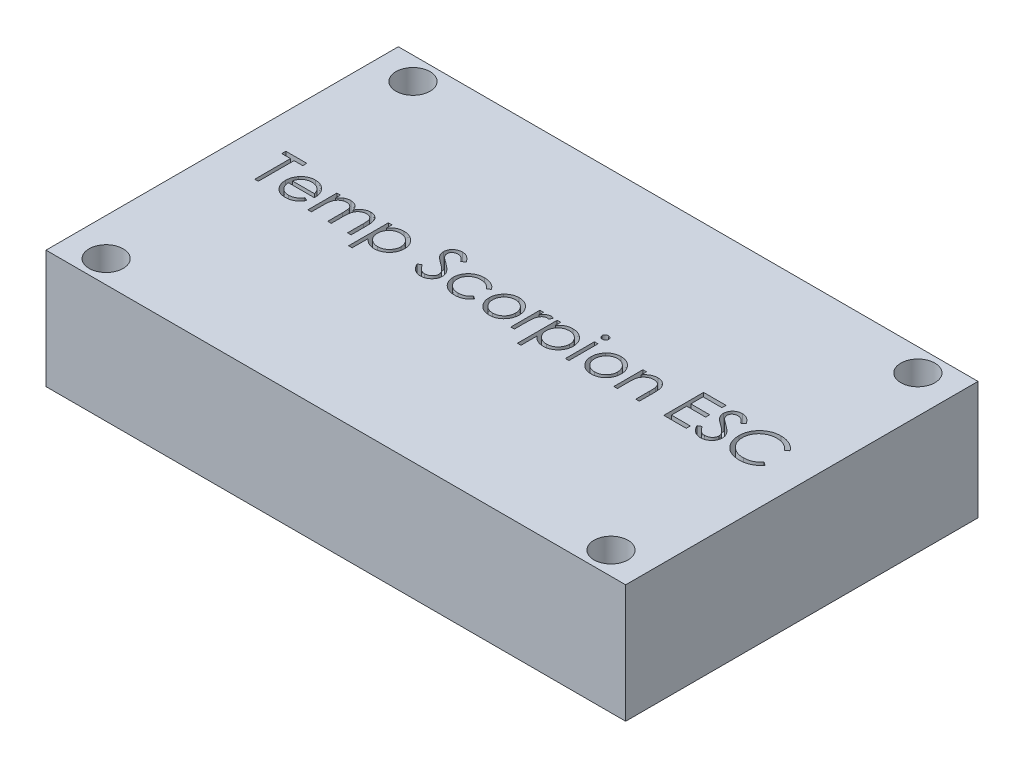
from build123d import *

# Parameters (mm, degrees)
SKETCH1_W           = 51
SKETCH1_H           = 31
SKETCH1_R           = 1.5
BOSS_EXTRUDE1_DEPTH = 10.4
SKETCH2_W           = 0.314102564
SKETCH2_H           = 2.557692307
CUT_EXTRUDE1_DEPTH  = 1.4


with BuildPart() as part:
    # Sketch1 → Boss-Extrude1 (new body)
    with BuildSketch(Plane(origin=(0, 0, 0), x_dir=(1, 0, 0), z_dir=(0, 1, 0))):
        Rectangle(SKETCH1_W, SKETCH1_H)
        with Locations(Location((-22.209677419, -13.5, 0), (0, 0, 270))):
            Circle(SKETCH1_R, mode=Mode.SUBTRACT)
        with Locations(Location((-22.209677419, 13.5, 0), (0, 0, 270))):
            Circle(SKETCH1_R, mode=Mode.SUBTRACT)
        with Locations(Location((22.209677419, 13.5, 0), (0, 0, 270))):
            Circle(SKETCH1_R, mode=Mode.SUBTRACT)
        with Locations(Location((22.209677419, -13.5, 0), (0, 0, 270))):
            Circle(SKETCH1_R, mode=Mode.SUBTRACT)
    extrude(amount=BOSS_EXTRUDE1_DEPTH)

    # Sketch2 → Cut-Extrude1 (cut)
    # profile 1 of 16: a face of its own
    with BuildSketch(Plane(origin=(0, 10.4, 0), x_dir=(1, 0, 0), z_dir=(0, 1, 0))):
        Polygon((-22.48332484, 2.229690826), (-22.48332484, 2.588665185), (-20.64358125, 2.588665185), (-20.64358125, 2.229690826), (-21.406401763, 2.229690826), (-21.406401763, -0.911334815), (-21.720504327, -0.911334815), (-21.720504327, 2.229690826), align=None)
    # profile 2 of 16: a face of its own
    with BuildSketch(Plane(origin=(0, 10.4, 0), x_dir=(1, 0, 0), z_dir=(0, 1, 0))):
        with BuildLine():
            Line((-18.095704647, -0.103642508), (-17.816658173, -0.250176963))
            add(Edge.make_bspline(
                [(-17.816658173, -0.250176963), (-17.838894768, -0.289620294), (-17.882158377, -0.366361397), (-17.956559125, -0.471793257), (-18.034551197, -0.566640973), (-18.119655165, -0.648370627), (-18.209324844, -0.719622012), (-18.304057499, -0.781959837), (-18.404346317, -0.835078357), (-18.510196042, -0.879830885), (-18.622495593, -0.914240379), (-18.741517109, -0.9385446), (-18.867488604, -0.953567869), (-18.953834784, -0.95531301), (-18.998048397, -0.95620661)],
                knots=[0, 0, 0, 0, 1.120438281, 2.179929193, 3.190490725, 4.156257408, 5.095198341, 6.022838206, 6.959905092, 7.901321166, 8.864066838, 9.862729781, 10.905609505, 12, 12, 12, 12], degree=3))
            add(Edge.make_bspline(
                [(-18.998048397, -0.95620661), (-19.047190375, -0.955059435), (-19.143052137, -0.952821628), (-19.282591884, -0.933529164), (-19.413971302, -0.902056805), (-19.537183006, -0.858091264), (-19.651925258, -0.800663939), (-19.758426113, -0.730704458), (-19.857245639, -0.648572203), (-19.945269848, -0.553555759), (-20.024513731, -0.451873802), (-20.094439551, -0.345917918), (-20.152896982, -0.235954693), (-20.200449592, -0.122684169), (-20.238854457, -0.006820276), (-20.265621161, 0.112691192), (-20.281050909, 0.235526776), (-20.283415354, 0.318624112), (-20.284606891, 0.360500121)],
                knots=[0, 0, 0, 0, 1.145258523, 2.234067595, 3.276747158, 4.290159414, 5.277019952, 6.260822364, 7.254936242, 8.264827045, 9.274100331, 10.257902744, 11.220704747, 12.172965371, 13.118907548, 14.062713208, 15.023725156, 16, 16, 16, 16], degree=3))
            add(Edge.make_bspline(
                [(-20.284606891, 0.360500121), (-20.28354775, 0.399794951), (-20.281448671, 0.477672116), (-20.268217884, 0.59293766), (-20.244769591, 0.704966113), (-20.212593267, 0.813850561), (-20.171042021, 0.919408695), (-20.120209802, 1.021704758), (-20.060017424, 1.120629898), (-20.01354475, 1.183033032), (-19.990135737, 1.214466467)],
                knots=[0, 0, 0, 0, 1.024358464, 2.0301432, 3.019427413, 4.004406732, 4.986367066, 5.972626655, 6.978780325, 8, 8, 8, 8], degree=3))
            add(Edge.make_bspline(
                [(-19.990135737, 1.214466467), (-19.958428054, 1.252335337), (-19.896017108, 1.326873487), (-19.790460752, 1.424811813), (-19.676160556, 1.506855588), (-19.55454893, 1.574862724), (-19.424212456, 1.626536371), (-19.286903165, 1.665043954), (-19.141057579, 1.686621965), (-19.041352358, 1.689669798), (-18.990336058, 1.691229287)],
                knots=[0, 0, 0, 0, 1.030682036, 2.02871468, 2.997146059, 3.962720338, 4.930598197, 5.918074684, 6.934738563, 8, 8, 8, 8], degree=3))
            add(Edge.make_bspline(
                [(-18.990336058, 1.691229287), (-18.937888452, 1.689875238), (-18.834998206, 1.687218903), (-18.684966085, 1.66259257), (-18.543005369, 1.623540015), (-18.409172865, 1.568386225), (-18.283455004, 1.497226673), (-18.166668954, 1.409084831), (-18.056817442, 1.306666744), (-17.992908863, 1.227903535), (-17.960388141, 1.187823839)],
                knots=[0, 0, 0, 0, 1.056321875, 2.072262726, 3.055038591, 4.01806755, 4.982017516, 5.957941055, 6.960871419, 8, 8, 8, 8], degree=3))
            add(Edge.make_bspline(
                [(-17.960388141, 1.187823839), (-17.938261203, 1.157620257), (-17.89415461, 1.097414138), (-17.83890751, 0.999242981), (-17.790950115, 0.896532387), (-17.752617154, 0.78762209), (-17.721577652, 0.67380251), (-17.699120834, 0.554259965), (-17.685951215, 0.429030054), (-17.683362518, 0.343703498), (-17.682042788, 0.300203646)],
                knots=[0, 0, 0, 0, 0.94817472, 1.890038105, 2.849395472, 3.817997239, 4.812318967, 5.836947057, 6.897266129, 8, 8, 8, 8], degree=3))
            Line((-17.682042788, 0.300203646), (-19.970504327, 0.300203646))
            add(Edge.make_bspline(
                [(-19.970504327, 0.300203646), (-19.968964721, 0.266503182), (-19.965937147, 0.200232578), (-19.951822003, 0.103261795), (-19.92957323, 0.010888453), (-19.898304167, -0.076194589), (-19.860437322, -0.159124717), (-19.814051605, -0.237286753), (-19.758712051, -0.310324684), (-19.696986352, -0.378891821), (-19.628279256, -0.439952582), (-19.555996509, -0.494604359), (-19.479102944, -0.540409955), (-19.398204861, -0.577589845), (-19.313433075, -0.606696161), (-19.22476088, -0.626563982), (-19.132362764, -0.639871089), (-19.06937703, -0.641350754), (-19.037311218, -0.642104046)],
                knots=[0, 0, 0, 0, 1.094153842, 2.151609401, 3.174256925, 4.172055639, 5.149267565, 6.128595816, 7.11444997, 8.118368179, 9.117203808, 10.09244225, 11.054858984, 12.015122123, 12.976791628, 13.957293641, 14.960065497, 16, 16, 16, 16], degree=3))
            add(Edge.make_bspline(
                [(-19.037311218, -0.642104046), (-19.00596007, -0.641495989), (-18.943753379, -0.640289488), (-18.851112522, -0.628557577), (-18.759972995, -0.609587302), (-18.670712011, -0.583697312), (-18.585141166, -0.55212046), (-18.505895615, -0.514017602), (-18.4330154, -0.471867855), (-18.364898433, -0.42365818), (-18.29882744, -0.364649993), (-18.233284953, -0.291014272), (-18.1630083, -0.203926744), (-18.119018707, -0.138381078), (-18.095704647, -0.103642508)],
                knots=[0, 0, 0, 0, 0.99110716, 1.966546729, 2.947904876, 3.932708344, 4.903319531, 5.828989031, 6.710028674, 7.56322171, 8.463672341, 9.504779593, 10.677557249, 12, 12, 12, 12], degree=3))
        make_face()
        with BuildLine():
            add(Edge.make_bspline(
                [(-17.996145353, 0.61430621), (-18.007641977, 0.655969084), (-18.029769279, 0.736156705), (-18.076005643, 0.847197595), (-18.128077184, 0.945885496), (-18.189698915, 1.031465129), (-18.259517641, 1.107468642), (-18.340162823, 1.173887227), (-18.430598717, 1.233304678), (-18.530357858, 1.283457178), (-18.635999643, 1.326147037), (-18.746605835, 1.354772152), (-18.859463623, 1.374381695), (-18.935797909, 1.376207803), (-18.974210256, 1.377126723)],
                knots=[0, 0, 0, 0, 1.154881502, 2.222775134, 3.210006277, 4.132804581, 5.035138423, 5.962687519, 6.919655026, 7.923214229, 8.944639381, 9.960483929, 10.97369054, 12, 12, 12, 12], degree=3))
            add(Edge.make_bspline(
                [(-18.974210256, 1.377126723), (-19.005559695, 1.376515052), (-19.067530944, 1.375305906), (-19.158832012, 1.363835776), (-19.246511711, 1.344875931), (-19.331216999, 1.318910975), (-19.411837867, 1.284302372), (-19.490032635, 1.243719146), (-19.563813032, 1.194177562), (-19.609954327, 1.156418707), (-19.633264744, 1.137343069)],
                knots=[0, 0, 0, 0, 1.04873581, 2.073130211, 3.073294108, 4.04793562, 5.032784715, 6.005352987, 6.992311501, 8, 8, 8, 8], degree=3))
            add(Edge.make_bspline(
                [(-19.633264744, 1.137343069), (-19.649958026, 1.122248754), (-19.68374116, 1.091701538), (-19.728881681, 1.039072331), (-19.772102154, 0.982320769), (-19.811435807, 0.919275644), (-19.847513393, 0.850654865), (-19.88127337, 0.77703723), (-19.911659782, 0.6978641), (-19.928755893, 0.642691661), (-19.937551603, 0.61430621)],
                knots=[0, 0, 0, 0, 0.879870761, 1.780643979, 2.707998968, 3.669668524, 4.684282772, 5.740141944, 6.837334558, 8, 8, 8, 8], degree=3))
            Line((-19.937551603, 0.61430621), (-17.996145353, 0.61430621))
        make_face(mode=Mode.SUBTRACT)
    # profile 3 of 16: a face of its own
    with BuildSketch(Plane(origin=(0, 10.4, 0), x_dir=(1, 0, 0), z_dir=(0, 1, 0))):
        with BuildLine():
            Line((-17.05383766, 1.646357492), (-16.739735096, 1.646357492))
            Line((-16.739735096, 1.646357492), (-16.739735096, 1.201846274))
            add(Edge.make_bspline(
                [(-16.739735096, 1.201846274), (-16.711451146, 1.240733876), (-16.657256387, 1.315246249), (-16.568390734, 1.413436533), (-16.479614622, 1.496764688), (-16.41568124, 1.54050756), (-16.384967468, 1.561521755)],
                knots=[0, 0, 0, 0, 1.134379233, 2.173579362, 3.122582517, 4, 4, 4, 4], degree=3))
            add(Edge.make_bspline(
                [(-16.384967468, 1.561521755), (-16.343102806, 1.58152712), (-16.260104906, 1.621188334), (-16.128685681, 1.661421893), (-15.994211012, 1.686146994), (-15.903402798, 1.689528367), (-15.857723878, 1.691229287)],
                knots=[0, 0, 0, 0, 1.014936303, 2.012140481, 3.000054389, 4, 4, 4, 4], degree=3))
            add(Edge.make_bspline(
                [(-15.857723878, 1.691229287), (-15.826830882, 1.690183996), (-15.765695303, 1.688115422), (-15.675111213, 1.674655387), (-15.587252601, 1.651389214), (-15.502638571, 1.61898189), (-15.422917892, 1.579735203), (-15.349828694, 1.533685495), (-15.284204486, 1.48198842), (-15.226078435, 1.422309487), (-15.173809409, 1.352972888), (-15.125730563, 1.272108639), (-15.08130535, 1.177900978), (-15.056684042, 1.109534437), (-15.043721474, 1.073540986)],
                knots=[0, 0, 0, 0, 1.009824226, 1.998387844, 2.986035974, 3.974953746, 4.955485308, 5.885931332, 6.793869504, 7.679848016, 8.601185859, 9.625726857, 10.749998409, 12, 12, 12, 12], degree=3))
            add(Edge.make_bspline(
                [(-15.043721474, 1.073540986), (-15.030010223, 1.098265405), (-15.003028406, 1.14691959), (-14.957722769, 1.215777852), (-14.910254972, 1.280184644), (-14.860220479, 1.340191069), (-14.807795892, 1.395500799), (-14.752734492, 1.446296701), (-14.695349711, 1.492796914), (-14.615557471, 1.547120074), (-14.511744863, 1.604821255), (-14.380856749, 1.654849699), (-14.244706577, 1.685765828), (-14.152288879, 1.6893961), (-14.105620513, 1.691229287)],
                knots=[0, 0, 0, 0, 0.86119277, 1.694706429, 2.50939023, 3.298075842, 4.073795165, 4.829715201, 5.57930267, 6.321991688, 7.768977793, 9.186738141, 10.579381044, 12, 12, 12, 12], degree=3))
            add(Edge.make_bspline(
                [(-14.105620513, 1.691229287), (-14.06273905, 1.689612066), (-13.978815864, 1.686447008), (-13.856638598, 1.661593535), (-13.742696793, 1.618915888), (-13.637219717, 1.560682251), (-13.542059903, 1.487503068), (-13.459343594, 1.40043423), (-13.389573231, 1.300091607), (-13.343994591, 1.205699618), (-13.313079327, 1.122364286), (-13.294018092, 1.051357994), (-13.277178397, 0.973206441), (-13.263197152, 0.88781618), (-13.2529786, 0.794885572), (-13.245407885, 0.694566696), (-13.240283811, 0.586781584), (-13.239921739, 0.512416084), (-13.239735096, 0.474081851)],
                knots=[0, 0, 0, 0, 1.209669288, 2.367440248, 3.500751976, 4.631527125, 5.755587489, 6.87532382, 8.007944318, 9.190864318, 9.82315674, 10.514484317, 11.263564316, 12.079023757, 12.955305781, 13.901327259, 14.918167583, 16, 16, 16, 16], degree=3))
            Line((-13.239735096, 0.474081851), (-13.239735096, -0.911334815))
            Line((-13.239735096, -0.911334815), (-13.55383766, -0.911334815))
            Line((-13.55383766, -0.911334815), (-13.55383766, 0.475484095))
            add(Edge.make_bspline(
                [(-13.55383766, 0.475484095), (-13.553915543, 0.508204669), (-13.554065223, 0.571088636), (-13.556758854, 0.661341087), (-13.561834168, 0.743609444), (-13.567768807, 0.817781532), (-13.576012616, 0.884030321), (-13.586658548, 0.942222739), (-13.597936228, 0.992816551), (-13.616672219, 1.048902598), (-13.646620111, 1.110772809), (-13.692237591, 1.177496385), (-13.749707697, 1.235577185), (-13.816067853, 1.285995502), (-13.891616298, 1.326989143), (-13.974881021, 1.356265152), (-14.065345073, 1.374388031), (-14.127967861, 1.376194046), (-14.160308013, 1.377126723)],
                knots=[0, 0, 0, 0, 1.253487763, 2.409012846, 3.458416907, 4.410876679, 5.259312806, 6.014470957, 6.676830364, 7.243083969, 8.276244668, 9.299465089, 10.325150304, 11.392391894, 12.482080715, 13.603491619, 14.762376348, 16, 16, 16, 16], degree=3))
            add(Edge.make_bspline(
                [(-14.160308013, 1.377126723), (-14.199977967, 1.375710566), (-14.278380878, 1.3729117), (-14.392826365, 1.344337827), (-14.502797381, 1.301257577), (-14.605012514, 1.23882512), (-14.699040305, 1.164016756), (-14.779939883, 1.07506716), (-14.846772068, 0.974437233), (-14.892026044, 0.881290531), (-14.920615345, 0.797621087), (-14.939492261, 0.724523715), (-14.954175653, 0.641442147), (-14.967946182, 0.548934656), (-14.97693391, 0.446364476), (-14.985102282, 0.334206075), (-14.988923145, 0.212122115), (-14.989457604, 0.127495427), (-14.989735096, 0.083557012)],
                knots=[0, 0, 0, 0, 1.090531906, 2.155305635, 3.229839962, 4.33261226, 5.44038871, 6.529323825, 7.629011124, 8.757537029, 9.370236727, 10.061839251, 10.834451254, 11.692844982, 12.636905849, 13.66920014, 14.789842145, 16, 16, 16, 16], degree=3))
            Line((-14.989735096, 0.083557012), (-14.989735096, -0.911334815))
            Line((-14.989735096, -0.911334815), (-15.30383766, -0.911334815))
            Line((-15.30383766, -0.911334815), (-15.30383766, 0.389246114))
            add(Edge.make_bspline(
                [(-15.30383766, 0.389246114), (-15.303917091, 0.425939433), (-15.304069908, 0.49653369), (-15.306746226, 0.597767365), (-15.311832847, 0.689848446), (-15.317713396, 0.772669909), (-15.326173574, 0.846081238), (-15.335783336, 0.910475996), (-15.347131947, 0.965692747), (-15.365921832, 1.026256132), (-15.3946363, 1.092977055), (-15.440824562, 1.164118076), (-15.498432142, 1.226386174), (-15.566003018, 1.279544922), (-15.6420087, 1.323486403), (-15.725992101, 1.355146155), (-15.817197014, 1.373570445), (-15.88007472, 1.375918942), (-15.912411378, 1.377126723)],
                knots=[0, 0, 0, 0, 1.320475261, 2.540461679, 3.643808994, 4.639130445, 5.527981419, 6.302341397, 6.981980563, 7.553956391, 8.582137848, 9.585246428, 10.591171744, 11.620968678, 12.668337649, 13.738356861, 14.836885341, 16, 16, 16, 16], degree=3))
            add(Edge.make_bspline(
                [(-15.912411378, 1.377126723), (-15.95042759, 1.375596263), (-16.026192549, 1.372546111), (-16.137494519, 1.345091837), (-16.244980202, 1.302087762), (-16.346934901, 1.242427943), (-16.440609049, 1.168528864), (-16.522617317, 1.081613969), (-16.591559842, 0.982764935), (-16.637291657, 0.890600419), (-16.666790131, 0.809027144), (-16.686385466, 0.739676196), (-16.703225092, 0.662675948), (-16.715739114, 0.577788837), (-16.727819529, 0.485567742), (-16.733649838, 0.385553253), (-16.7393214, 0.277831165), (-16.739593815, 0.20345862), (-16.739735096, 0.16488714)],
                knots=[0, 0, 0, 0, 1.098833095, 2.189935336, 3.297829714, 4.440610912, 5.596351641, 6.740013378, 7.886572111, 9.072425424, 9.705826452, 10.395263256, 11.156850408, 11.985370555, 12.878090359, 13.847760091, 14.883794034, 16, 16, 16, 16], degree=3))
            Line((-16.739735096, 0.16488714), (-16.739735096, -0.911334815))
            Line((-16.739735096, -0.911334815), (-17.05383766, -0.911334815))
            Line((-17.05383766, -0.911334815), (-17.05383766, 1.646357492))
        make_face()
    # profile 4 of 16: a face of its own
    with BuildSketch(Plane(origin=(0, 10.4, 0), x_dir=(1, 0, 0), z_dir=(0, 1, 0))):
        with BuildLine():
            Line((-12.521786378, 1.646357492), (-12.207683814, 1.646357492))
            Line((-12.207683814, 1.646357492), (-12.207683814, 1.173100281))
            add(Edge.make_bspline(
                [(-12.207683814, 1.173100281), (-12.17432633, 1.216038015), (-12.109502735, 1.299478908), (-11.997777831, 1.407469036), (-11.879851022, 1.49854434), (-11.752687609, 1.569926873), (-11.618263919, 1.623747685), (-11.477131602, 1.663527135), (-11.328092837, 1.686968609), (-11.226196384, 1.68979027), (-11.174230288, 1.691229287)],
                knots=[0, 0, 0, 0, 1.0828784, 2.104357462, 3.088488658, 4.04616522, 5.001424249, 5.969181776, 6.964304535, 8, 8, 8, 8], degree=3))
            add(Edge.make_bspline(
                [(-11.174230288, 1.691229287), (-11.128838685, 1.689916108), (-11.039119797, 1.687320541), (-10.907056568, 1.669747487), (-10.779881185, 1.639629794), (-10.658313131, 1.596228879), (-10.541050065, 1.542573409), (-10.429827966, 1.474856373), (-10.32291441, 1.396450183), (-10.222998221, 1.306218032), (-10.130676853, 1.208589765), (-10.050830672, 1.103567461), (-9.981958768, 0.994604875), (-9.926288471, 0.880012783), (-9.882680124, 0.760693553), (-9.851665446, 0.636165112), (-9.833207803, 0.506889171), (-9.830731351, 0.418986451), (-9.829478686, 0.374522556)],
                knots=[0, 0, 0, 0, 1.041296284, 2.058176809, 3.050446431, 4.034000596, 5.01514041, 6.003636468, 7.015969324, 8.052561599, 9.08815499, 10.094063707, 11.074456064, 12.040834395, 13.011057502, 13.983766392, 14.980127149, 16, 16, 16, 16], degree=3))
            add(Edge.make_bspline(
                [(-9.829478686, 0.374522556), (-9.830704171, 0.329120248), (-9.833121006, 0.239580343), (-9.851866012, 0.108093246), (-9.881822886, -0.018394128), (-9.924881069, -0.139671391), (-9.980522557, -0.255655042), (-10.048227118, -0.366261439), (-10.128113585, -0.471455142), (-10.219414713, -0.569808042), (-10.318467649, -0.660407355), (-10.424345138, -0.739645424), (-10.535404064, -0.8061868), (-10.651076231, -0.861769759), (-10.772351869, -0.903661943), (-10.898665147, -0.933879744), (-11.029947294, -0.95251424), (-11.119248446, -0.954966382), (-11.164414583, -0.95620661)],
                knots=[0, 0, 0, 0, 1.038740735, 2.04854663, 3.033179607, 4.009277356, 4.987731542, 5.972001279, 6.972200261, 8.005528982, 9.039189865, 10.040446548, 11.026516639, 11.997840187, 12.972163198, 13.956796175, 14.96660207, 16, 16, 16, 16], degree=3))
            add(Edge.make_bspline(
                [(-11.164414583, -0.95620661), (-11.215242155, -0.954911802), (-11.315641511, -0.952354178), (-11.462439182, -0.926434768), (-11.603716034, -0.887697832), (-11.737906858, -0.830998838), (-11.866074671, -0.758743322), (-11.987494477, -0.670633116), (-12.10281123, -0.566852492), (-12.172219987, -0.488120676), (-12.207683814, -0.447893309)],
                knots=[0, 0, 0, 0, 1.014726462, 2.004382257, 2.969841629, 3.936926163, 4.907207904, 5.903978561, 6.929055279, 8, 8, 8, 8], degree=3))
            Line((-12.207683814, -0.447893309), (-12.207683814, -1.853642508))
            Line((-12.207683814, -1.853642508), (-12.521786378, -1.853642508))
            Line((-12.521786378, -1.853642508), (-12.521786378, 1.646357492))
        make_face()
        with BuildLine():
            add(Edge.make_bspline(
                [(-11.177034776, 1.377126723), (-11.212614338, 1.376486465), (-11.282661326, 1.375225962), (-11.385333545, 1.360252013), (-11.484228973, 1.338514272), (-11.578350924, 1.305602371), (-11.668601541, 1.265203558), (-11.754285705, 1.214721547), (-11.835343273, 1.155069541), (-11.911570303, 1.087390197), (-11.980433597, 1.012815509), (-12.041396525, 0.9332277), (-12.09260383, 0.84872756), (-12.13510585, 0.760102198), (-12.167449133, 0.666656913), (-12.190404853, 0.5689239), (-12.204835205, 0.466796188), (-12.206724143, 0.397240181), (-12.207683814, 0.361902364)],
                knots=[0, 0, 0, 0, 1.05670511, 2.080379991, 3.077984906, 4.06214886, 5.038337365, 6.01289324, 7.01187578, 8.025460281, 9.038092164, 10.024533457, 11.000252242, 11.969694649, 12.940728589, 13.933144304, 14.949937299, 16, 16, 16, 16], degree=3))
            add(Edge.make_bspline(
                [(-12.207683814, 0.361902364), (-12.206092958, 0.315514252), (-12.202976336, 0.22463601), (-12.177638968, 0.091851889), (-12.136403704, -0.033799767), (-12.077874991, -0.151260804), (-12.003927416, -0.259243639), (-11.91482926, -0.355934246), (-11.811386709, -0.440724837), (-11.695319517, -0.51214609), (-11.570897386, -0.570134157), (-11.441111474, -0.611648367), (-11.307746594, -0.637220595), (-11.217578274, -0.640467415), (-11.172126923, -0.642104046)],
                knots=[0, 0, 0, 0, 1.03728447, 2.032128127, 3.01272805, 3.987917167, 4.958271349, 5.931593992, 6.91984656, 7.941419022, 8.973179163, 9.983609215, 10.983593296, 12, 12, 12, 12], degree=3))
            add(Edge.make_bspline(
                [(-11.172126923, -0.642104046), (-11.127591155, -0.640547669), (-11.039195662, -0.637458541), (-10.909037541, -0.610720353), (-10.782546902, -0.569875329), (-10.66236673, -0.510315772), (-10.549543242, -0.437325714), (-10.447661688, -0.349765681), (-10.358654775, -0.248275738), (-10.28279042, -0.135267235), (-10.221658935, -0.014091851), (-10.175728695, 0.111289537), (-10.149220121, 0.24043496), (-10.145463333, 0.327432673), (-10.14358125, 0.371016948)],
                knots=[0, 0, 0, 0, 1.00104056, 1.986885549, 2.97790532, 3.984399681, 4.995088187, 5.994304198, 6.996462723, 8.023150851, 9.048424203, 10.043036403, 11.019596776, 12, 12, 12, 12], degree=3))
            add(Edge.make_bspline(
                [(-10.14358125, 0.371016948), (-10.145035984, 0.414871937), (-10.147934118, 0.50224024), (-10.176481155, 0.631003143), (-10.219381133, 0.756891119), (-10.281940185, 0.876411669), (-10.356141455, 0.989185752), (-10.445888451, 1.088739631), (-10.546504648, 1.175910303), (-10.659193812, 1.247925713), (-10.780134237, 1.305211208), (-10.907449153, 1.347094847), (-11.040492756, 1.372268597), (-11.13112041, 1.375493103), (-11.177034776, 1.377126723)],
                knots=[0, 0, 0, 0, 0.983928682, 1.960191568, 2.949917689, 3.96440592, 4.982380491, 5.975291189, 6.965713506, 7.964880129, 8.970154049, 9.96478489, 10.968906225, 12, 12, 12, 12], degree=3))
        make_face(mode=Mode.SUBTRACT)
    # profile 5 of 16: a face of its own
    with BuildSketch(Plane(origin=(0, 10.4, 0), x_dir=(1, 0, 0), z_dir=(0, 1, 0))):
        with BuildLine():
            Line((-8.124350481, -0.236154527), (-7.828477083, -0.058770713))
            add(Edge.make_bspline(
                [(-7.828477083, -0.058770713), (-7.800958846, -0.104835098), (-7.748234965, -0.193092682), (-7.660283606, -0.312350722), (-7.569150695, -0.413712879), (-7.474161362, -0.496589486), (-7.375895413, -0.561838373), (-7.27371136, -0.608040605), (-7.167953549, -0.63685658), (-7.095979728, -0.640356667), (-7.060047596, -0.642104046)],
                knots=[0, 0, 0, 0, 1.272034388, 2.437168799, 3.508375237, 4.49857839, 5.41946034, 6.295179144, 7.148887113, 8, 8, 8, 8], degree=3))
            add(Edge.make_bspline(
                [(-7.060047596, -0.642104046), (-7.029360736, -0.641249374), (-6.968523963, -0.639554983), (-6.87896172, -0.623274181), (-6.791979917, -0.598262052), (-6.70937128, -0.562441121), (-6.632275665, -0.519102635), (-6.56466897, -0.466756458), (-6.506222857, -0.408150252), (-6.458413742, -0.342767597), (-6.421733707, -0.272450449), (-6.393541638, -0.200274497), (-6.377896565, -0.125105929), (-6.375539811, -0.074495466), (-6.374350481, -0.048955008)],
                knots=[0, 0, 0, 0, 1.095163259, 2.171163733, 3.241058638, 4.321873601, 5.38011039, 6.391990106, 7.366004449, 8.327778327, 9.272591725, 10.192022065, 11.087607919, 12, 12, 12, 12], degree=3))
            add(Edge.make_bspline(
                [(-6.374350481, -0.048955008), (-6.375824792, -0.019814158), (-6.37882185, 0.039424931), (-6.40415333, 0.126824584), (-6.444002577, 0.213317154), (-6.48076522, 0.26681842), (-6.499851282, 0.294594672)],
                knots=[0, 0, 0, 0, 0.938893495, 1.908633276, 2.914225137, 4, 4, 4, 4], degree=3))
            add(Edge.make_bspline(
                [(-6.499851282, 0.294594672), (-6.515521896, 0.314641495), (-6.548420391, 0.356727294), (-6.604977903, 0.41937253), (-6.671344017, 0.483990948), (-6.745247572, 0.553050005), (-6.829380661, 0.623337802), (-6.921108176, 0.69820608), (-7.022772035, 0.774807657), (-7.094071531, 0.826180223), (-7.130860897, 0.852687621)],
                knots=[0, 0, 0, 0, 0.722233717, 1.516239348, 2.393582979, 3.351407094, 4.387010283, 5.505090956, 6.712668013, 8, 8, 8, 8], degree=3))
            add(Edge.make_bspline(
                [(-7.130860897, 0.852687621), (-7.167684894, 0.878916208), (-7.23808957, 0.92906327), (-7.336548153, 1.003487554), (-7.424592616, 1.071531424), (-7.501831632, 1.133835436), (-7.568231229, 1.190408041), (-7.62431464, 1.24070598), (-7.668653197, 1.286089541), (-7.693308778, 1.315530883), (-7.704378526, 1.328749319)],
                knots=[0, 0, 0, 0, 1.452282411, 2.77665338, 3.964542531, 5.026858415, 5.96415736, 6.766646006, 7.446254459, 8, 8, 8, 8], degree=3))
            add(Edge.make_bspline(
                [(-7.704378526, 1.328749319), (-7.719851071, 1.349350356), (-7.750279908, 1.38986506), (-7.790445913, 1.453189918), (-7.824585076, 1.518013183), (-7.851347408, 1.584509048), (-7.873883627, 1.651743977), (-7.889041558, 1.720595222), (-7.898532954, 1.790753841), (-7.899504941, 1.837967341), (-7.899991506, 1.861601883)],
                knots=[0, 0, 0, 0, 1.068054152, 2.10047183, 3.106115577, 4.101338837, 5.06977816, 6.043150881, 7.020423561, 8, 8, 8, 8], degree=3))
            add(Edge.make_bspline(
                [(-7.899991506, 1.861601883), (-7.898686297, 1.898631658), (-7.896103777, 1.971899722), (-7.87426326, 2.078930552), (-7.839790366, 2.181116969), (-7.791495479, 2.277447303), (-7.729238126, 2.365413284), (-7.657192151, 2.446026771), (-7.571380665, 2.513795353), (-7.477228042, 2.573007412), (-7.37417167, 2.619353337), (-7.266180766, 2.654314317), (-7.153083694, 2.674123575), (-7.07648056, 2.67696634), (-7.037611699, 2.678408774)],
                knots=[0, 0, 0, 0, 1.005424448, 1.989358655, 2.955360095, 3.929531133, 4.905563448, 5.876582895, 6.856512386, 7.866279853, 8.892233794, 9.918561126, 10.94386622, 12, 12, 12, 12], degree=3))
            add(Edge.make_bspline(
                [(-7.037611699, 2.678408774), (-6.996367598, 2.676986223), (-6.914346247, 2.674157222), (-6.793697031, 2.64955969), (-6.677536315, 2.608859019), (-6.58409305, 2.562670361), (-6.510960288, 2.516538945), (-6.455187556, 2.474519121), (-6.398670105, 2.426144012), (-6.34095205, 2.371284766), (-6.283011391, 2.309438015), (-6.223987938, 2.241027326), (-6.16374367, 2.16647077), (-6.12498781, 2.113246269), (-6.105119712, 2.085960858)],
                knots=[0, 0, 0, 0, 1.286793592, 2.559021753, 3.825965368, 5.121522368, 5.803751409, 6.523245864, 7.299691795, 8.125521123, 9.008227632, 9.944561021, 10.946284179, 12, 12, 12, 12], degree=3))
            Line((-6.105119712, 2.085960858), (-6.389074038, 1.870716467))
            add(Edge.make_bspline(
                [(-6.389074038, 1.870716467), (-6.406219971, 1.892805157), (-6.439239028, 1.93534281), (-6.489368515, 1.994914126), (-6.536617163, 2.049330606), (-6.583167563, 2.096595734), (-6.626561194, 2.139297867), (-6.668678236, 2.175857624), (-6.708912588, 2.206633219), (-6.759629498, 2.239476779), (-6.823347217, 2.272033283), (-6.903331753, 2.299582361), (-6.986918028, 2.316137423), (-7.043847659, 2.31832631), (-7.072667788, 2.319434415)],
                knots=[0, 0, 0, 0, 1.181633172, 2.275549214, 3.290209073, 4.226197932, 5.078386478, 5.862611352, 6.581680152, 7.217281963, 8.414376989, 9.595101626, 10.782541182, 12, 12, 12, 12], degree=3))
            add(Edge.make_bspline(
                [(-7.072667788, 2.319434415), (-7.108824311, 2.318222715), (-7.178548758, 2.315886066), (-7.277538994, 2.290366081), (-7.366632919, 2.250184221), (-7.443185485, 2.193869243), (-7.506922462, 2.12714825), (-7.55302792, 2.050369395), (-7.580778085, 1.965586992), (-7.584164365, 1.906445336), (-7.585888942, 1.876325441)],
                knots=[0, 0, 0, 0, 1.14458467, 2.207223713, 3.21896685, 4.227309161, 5.202851033, 6.127160689, 7.046193047, 8, 8, 8, 8], degree=3))
            add(Edge.make_bspline(
                [(-7.585888942, 1.876325441), (-7.585495816, 1.857573963), (-7.58470892, 1.820040343), (-7.573734122, 1.764588921), (-7.559634793, 1.709277582), (-7.537292161, 1.654354999), (-7.506446858, 1.59886064), (-7.465941682, 1.541838902), (-7.41492837, 1.482787194), (-7.375851357, 1.44437982), (-7.355219872, 1.424101883)],
                knots=[0, 0, 0, 0, 0.858281714, 1.717966888, 2.583508476, 3.4729293, 4.427298488, 5.488583878, 6.674047936, 8, 8, 8, 8], degree=3))
            add(Edge.make_bspline(
                [(-7.355219872, 1.424101883), (-7.347558499, 1.417264858), (-7.329356832, 1.401021649), (-7.296080907, 1.374429369), (-7.252138108, 1.341626596), (-7.198675907, 1.30103928), (-7.134708545, 1.253957818), (-7.060228989, 1.200984206), (-6.976067456, 1.140398747), (-6.916345541, 1.098041206), (-6.884767147, 1.075644351)],
                knots=[0, 0, 0, 0, 0.420754252, 0.999615792, 1.744751191, 2.668019286, 3.750313428, 4.999500688, 6.413464383, 8, 8, 8, 8], degree=3))
            add(Edge.make_bspline(
                [(-6.884767147, 1.075644351), (-6.846781234, 1.048002992), (-6.773226778, 0.99447933), (-6.668569198, 0.91406365), (-6.57367539, 0.835415881), (-6.488212186, 0.759038274), (-6.411335278, 0.685510181), (-6.343897557, 0.613947001), (-6.285211877, 0.544861428), (-6.222032658, 0.456288853), (-6.157474839, 0.347507768), (-6.102033331, 0.21422953), (-6.067074984, 0.080433209), (-6.062503468, -0.009493627), (-6.060247917, -0.05386286)],
                knots=[0, 0, 0, 0, 1.163667725, 2.253281268, 3.268753668, 4.215851969, 5.092017293, 5.902905408, 6.650798638, 7.335211899, 8.59617414, 9.77448103, 10.901945474, 12, 12, 12, 12], degree=3))
            add(Edge.make_bspline(
                [(-6.060247917, -0.05386286), (-6.060905055, -0.085241225), (-6.06220657, -0.147388609), (-6.077167484, -0.238643686), (-6.099087149, -0.327274555), (-6.132124383, -0.412185668), (-6.172447541, -0.494930431), (-6.223613789, -0.573338331), (-6.282921474, -0.64914473), (-6.350955239, -0.720328221), (-6.425401141, -0.785674417), (-6.504084836, -0.843803478), (-6.587135108, -0.892271802), (-6.674101425, -0.931822644), (-6.765003762, -0.962756161), (-6.859811546, -0.98516903), (-6.958681057, -0.998924741), (-7.025881538, -1.000352503), (-7.060047596, -1.001078405)],
                knots=[0, 0, 0, 0, 0.983748083, 1.948392443, 2.894712957, 3.844097841, 4.80183111, 5.778335162, 6.776009319, 7.81870978, 8.863265674, 9.881300176, 10.883814829, 11.87499822, 12.874611388, 13.892143829, 14.928324115, 16, 16, 16, 16], degree=3))
            add(Edge.make_bspline(
                [(-7.060047596, -1.001078405), (-7.086482939, -1.000567223), (-7.139020699, -0.999551298), (-7.216730181, -0.990570018), (-7.29286977, -0.977862914), (-7.366484052, -0.957688844), (-7.438521464, -0.933211867), (-7.508668698, -0.903073534), (-7.576959752, -0.866956333), (-7.643777335, -0.825661308), (-7.70895151, -0.777603564), (-7.771870978, -0.721630067), (-7.834600163, -0.659284562), (-7.89528756, -0.588873999), (-7.955160704, -0.511535916), (-8.013039113, -0.426546733), (-8.070120831, -0.334369379), (-8.105936299, -0.269504293), (-8.124350481, -0.236154527)],
                knots=[0, 0, 0, 0, 0.915332311, 1.819136955, 2.706846663, 3.586547465, 4.459518054, 5.340707479, 6.227863349, 7.133153174, 8.059268498, 9.028702269, 10.047606654, 11.120612155, 12.245963614, 13.433783089, 14.680604001, 16, 16, 16, 16], degree=3))
        make_face()
    # profile 6 of 16: a face of its own
    with BuildSketch(Plane(origin=(0, 10.4, 0), x_dir=(1, 0, 0), z_dir=(0, 1, 0))):
        with BuildLine():
            Line((-2.919222276, 1.091770153), (-3.182142949, 0.928408774))
            add(Edge.make_bspline(
                [(-3.182142949, 0.928408774), (-3.210972814, 0.964237168), (-3.267719509, 1.034759279), (-3.366258746, 1.125769212), (-3.47127016, 1.203936254), (-3.584548208, 1.267640005), (-3.705934008, 1.316861455), (-3.834948859, 1.35169166), (-3.971574364, 1.373395903), (-4.065239563, 1.37586274), (-4.113232692, 1.377126723)],
                knots=[0, 0, 0, 0, 1.026593902, 2.0206758, 2.988051866, 3.946915611, 4.916868779, 5.907761954, 6.927957743, 8, 8, 8, 8], degree=3))
            add(Edge.make_bspline(
                [(-4.113232692, 1.377126723), (-4.151591649, 1.376069881), (-4.227138572, 1.373988459), (-4.338044725, 1.360977966), (-4.443687078, 1.337335957), (-4.544727787, 1.306185001), (-4.640448206, 1.264434711), (-4.731099124, 1.213624955), (-4.817484614, 1.154574914), (-4.897101356, 1.086164369), (-4.969930363, 1.011765701), (-5.033029277, 0.932012006), (-5.08796621, 0.849292115), (-5.131072166, 0.761540372), (-5.166347337, 0.670764319), (-5.189554057, 0.575250463), (-5.205018752, 0.476222456), (-5.206788081, 0.408704116), (-5.207683814, 0.374522556)],
                knots=[0, 0, 0, 0, 1.112346261, 2.190735716, 3.231507886, 4.247384806, 5.251966152, 6.253067467, 7.256802811, 8.280671706, 9.291813951, 10.270744147, 11.225547591, 12.165006084, 13.100104208, 14.043489273, 15.009504848, 16, 16, 16, 16], degree=3))
            add(Edge.make_bspline(
                [(-5.207683814, 0.374522556), (-5.205904562, 0.329753345), (-5.202370031, 0.24081815), (-5.174668572, 0.109540048), (-5.129324164, -0.017383642), (-5.067266314, -0.13905178), (-4.988789179, -0.251645935), (-4.896616616, -0.352629389), (-4.790697533, -0.440045417), (-4.671965202, -0.512517943), (-4.543207459, -0.57077931), (-4.405817354, -0.612286643), (-4.260917573, -0.637339016), (-4.161710826, -0.640494959), (-4.111129327, -0.642104046)],
                knots=[0, 0, 0, 0, 0.966302908, 1.919585723, 2.883856336, 3.870342332, 4.860282998, 5.839159637, 6.814385684, 7.815993281, 8.834850808, 9.858348828, 10.908058873, 12, 12, 12, 12], degree=3))
            add(Edge.make_bspline(
                [(-4.111129327, -0.642104046), (-4.064774143, -0.640804549), (-3.973673904, -0.638250692), (-3.840506619, -0.616721729), (-3.713726708, -0.581478095), (-3.593338678, -0.532330445), (-3.479562512, -0.468802929), (-3.373133337, -0.390443758), (-3.271933398, -0.299507158), (-3.212436422, -0.229189187), (-3.182142949, -0.193386097)],
                knots=[0, 0, 0, 0, 1.039848629, 2.043578496, 3.018386758, 3.987534228, 4.954977003, 5.934852016, 6.948509513, 8, 8, 8, 8], degree=3))
            Line((-3.182142949, -0.193386097), (-2.919222276, -0.365862059))
            add(Edge.make_bspline(
                [(-2.919222276, -0.365862059), (-2.934809978, -0.388752786), (-2.965933645, -0.434458262), (-3.01796127, -0.498902379), (-3.074081102, -0.559224061), (-3.134074199, -0.615342452), (-3.197157209, -0.668600471), (-3.265485118, -0.716452045), (-3.33685473, -0.761586868), (-3.412103887, -0.80219974), (-3.490454585, -0.838706062), (-3.571796575, -0.870097232), (-3.655776388, -0.897067338), (-3.742492764, -0.918504685), (-3.832116662, -0.935615524), (-3.924416297, -0.946969225), (-4.019359878, -0.955444506), (-4.08353203, -0.955950373), (-4.11603718, -0.95620661)],
                knots=[0, 0, 0, 0, 0.954134338, 1.905101784, 2.851144739, 3.791306361, 4.734911809, 5.6936923, 6.663572882, 7.643865596, 8.638447847, 9.640600242, 10.646758161, 11.676244097, 12.717260333, 13.78922464, 14.880174919, 16, 16, 16, 16], degree=3))
            add(Edge.make_bspline(
                [(-4.11603718, -0.95620661), (-4.165648063, -0.95531533), (-4.262885755, -0.953568416), (-4.405208263, -0.93435994), (-4.54122193, -0.905402324), (-4.670880288, -0.86383859), (-4.794203522, -0.810333815), (-4.911076641, -0.7449769), (-5.021112659, -0.66722511), (-5.123223442, -0.578462341), (-5.217004888, -0.4822217), (-5.297531078, -0.378371782), (-5.367376349, -0.270730734), (-5.423463892, -0.156921208), (-5.468110818, -0.038455835), (-5.498615651, 0.085614404), (-5.518345388, 0.214266659), (-5.520628768, 0.301999541), (-5.521786378, 0.346477685)],
                knots=[0, 0, 0, 0, 1.1129367, 2.181364009, 3.217532258, 4.231199276, 5.232079859, 6.230262199, 7.231623845, 8.250719726, 9.263571943, 10.242672461, 11.195837495, 12.138959767, 13.085126421, 14.0317438, 15.002148558, 16, 16, 16, 16], degree=3))
            add(Edge.make_bspline(
                [(-5.521786378, 0.346477685), (-5.521345362, 0.376656119), (-5.520468108, 0.436686007), (-5.51040618, 0.525781073), (-5.497407708, 0.613689619), (-5.47538197, 0.699297338), (-5.449941339, 0.783902628), (-5.417465807, 0.866485729), (-5.379370412, 0.947430402), (-5.336118465, 1.026528132), (-5.28742972, 1.102477671), (-5.233548486, 1.174231336), (-5.17650415, 1.242651101), (-5.113628038, 1.305374862), (-5.047588384, 1.364911053), (-4.976516809, 1.419669178), (-4.900820957, 1.469810169), (-4.821637634, 1.516261184), (-4.739012923, 1.557620619), (-4.653446253, 1.593253857), (-4.565453223, 1.623706433), (-4.474893079, 1.647815352), (-4.382366906, 1.668032775), (-4.287145568, 1.680750622), (-4.189593346, 1.689736895), (-4.123537323, 1.690727687), (-4.090095673, 1.691229287)],
                knots=[0, 0, 0, 0, 0.990994727, 1.971252077, 2.943264845, 3.907940874, 4.872158414, 5.844625996, 6.82015047, 7.809835459, 8.804511986, 9.781214284, 10.756496977, 11.728388426, 12.696359165, 13.676225489, 14.672885716, 15.677705647, 16.690706858, 17.706033469, 18.721040654, 19.747369689, 20.783475414, 21.830280724, 22.901553713, 24, 24, 24, 24], degree=3))
            add(Edge.make_bspline(
                [(-4.090095673, 1.691229287), (-4.048215565, 1.690307396), (-3.964664685, 1.688468222), (-3.840723979, 1.67298957), (-3.718608785, 1.649653153), (-3.600461681, 1.615080324), (-3.487715167, 1.573216668), (-3.382179717, 1.526203954), (-3.286339613, 1.47160935), (-3.198412024, 1.411889236), (-3.118232506, 1.34452833), (-3.044978014, 1.268721373), (-2.977146365, 1.184862894), (-2.938689653, 1.123057162), (-2.919222276, 1.091770153)],
                knots=[0, 0, 0, 0, 1.095225653, 2.184976855, 3.262915854, 4.344593502, 5.400796181, 6.407717688, 7.363229445, 8.282371371, 9.184954523, 10.097238608, 11.036792983, 12, 12, 12, 12], degree=3))
        make_face()
    # profile 7 of 16: a face of its own
    with BuildSketch(Plane(origin=(0, 10.4, 0), x_dir=(1, 0, 0), z_dir=(0, 1, 0))):
        with BuildLine():
            add(Edge.make_bspline(
                [(-1.055640545, 1.691229287), (-1.007649272, 1.690207396), (-0.913550114, 1.688203717), (-0.775742229, 1.666788752), (-0.644197093, 1.634041387), (-0.518410901, 1.588769825), (-0.399994605, 1.528087875), (-0.287223361, 1.455678584), (-0.180406352, 1.36989599), (-0.116383323, 1.303537922), (-0.083885737, 1.269855089)],
                knots=[0, 0, 0, 0, 1.054011418, 2.066658804, 3.057071809, 4.030435133, 4.997543892, 5.974964718, 6.972108034, 8, 8, 8, 8], degree=3))
            add(Edge.make_bspline(
                [(-0.083885737, 1.269855089), (-0.055903783, 1.237641103), (-0.000481403, 1.173836561), (0.070584316, 1.070380948), (0.131805876, 0.963240847), (0.180868837, 0.85099352), (0.219553861, 0.734618849), (0.247019557, 0.613716838), (0.263356492, 0.488554491), (0.265559459, 0.403550653), (0.26667516, 0.360500121)],
                knots=[0, 0, 0, 0, 1.025258237, 2.030674902, 3.01204498, 3.988269485, 4.97094183, 5.956517959, 6.965070386, 8, 8, 8, 8], degree=3))
            add(Edge.make_bspline(
                [(0.26667516, 0.360500121), (0.265693823, 0.317200063), (0.263754655, 0.23163713), (0.245411038, 0.105617764), (0.216879952, -0.016577059), (0.176048114, -0.134435753), (0.123690005, -0.24831858), (0.059799317, -0.357728129), (-0.0160723, -0.462880263), (-0.102076297, -0.562882101), (-0.197128173, -0.655048316), (-0.300244321, -0.735376585), (-0.409398355, -0.80419811), (-0.526041708, -0.859634525), (-0.649109195, -0.903344226), (-0.778866263, -0.934044242), (-0.915111333, -0.952605926), (-1.008138555, -0.954989499), (-1.055640545, -0.95620661)],
                knots=[0, 0, 0, 0, 0.998656419, 1.973391657, 2.932242238, 3.890759089, 4.846373663, 5.82037756, 6.809684879, 7.83454468, 8.860553229, 9.859544525, 10.845671541, 11.83227036, 12.833544569, 13.85385346, 14.904124723, 16, 16, 16, 16], degree=3))
            add(Edge.make_bspline(
                [(-1.055640545, -0.95620661), (-1.103375264, -0.954985414), (-1.196866124, -0.952593639), (-1.333592106, -0.934116357), (-1.463581725, -0.903358374), (-1.586810324, -0.859490881), (-1.70395517, -0.804196338), (-1.813741667, -0.735584648), (-1.916941583, -0.655024493), (-2.012013567, -0.562888556), (-2.098012173, -0.4628786), (-2.173885181, -0.357728561), (-2.237775507, -0.248318468), (-2.290133711, -0.134435783), (-2.330965524, -0.016577051), (-2.359496617, 0.105617762), (-2.377840231, 0.23163713), (-2.3797794, 0.317200063), (-2.380760737, 0.360500121)],
                knots=[0, 0, 0, 0, 1.099876186, 2.154163076, 3.173186993, 4.173200201, 5.163417411, 6.152872554, 7.150605724, 8.17532212, 9.198891216, 10.186952605, 11.159729845, 12.11414092, 13.071450619, 14.029093627, 15.002601286, 16, 16, 16, 16], degree=3))
            add(Edge.make_bspline(
                [(-2.380760737, 0.360500121), (-2.379637427, 0.403316666), (-2.377413465, 0.488086069), (-2.361092956, 0.61301313), (-2.3337344, 0.733710519), (-2.295003003, 0.849635995), (-2.245487813, 0.961391431), (-2.185126525, 1.068796262), (-2.113335892, 1.171784062), (-2.05813394, 1.235506142), (-2.03019984, 1.267751723)],
                knots=[0, 0, 0, 0, 1.031353054, 2.041901799, 3.029428768, 4.008703097, 4.981709435, 5.96992636, 6.972712378, 8, 8, 8, 8], degree=3))
            add(Edge.make_bspline(
                [(-2.03019984, 1.267751723), (-1.997751249, 1.301726662), (-1.933935385, 1.368544359), (-1.826586657, 1.454076883), (-1.714092836, 1.527992957), (-1.59436791, 1.587469172), (-1.468685052, 1.63430769), (-1.336465809, 1.666873205), (-1.198190294, 1.68812656), (-1.103630673, 1.690184738), (-1.055640545, 1.691229287)],
                knots=[0, 0, 0, 0, 1.027980169, 2.021703884, 2.998553061, 3.971491411, 4.943284454, 5.930300938, 6.949603206, 8, 8, 8, 8], degree=3))
        make_face()
        with BuildLine():
            add(Edge.make_bspline(
                [(-1.057042788, 1.377126723), (-1.0909804, 1.376162131), (-1.157979528, 1.374257849), (-1.256599113, 1.359773944), (-1.351539267, 1.33682644), (-1.442980111, 1.304222384), (-1.530613284, 1.262123485), (-1.614522686, 1.210415125), (-1.694955126, 1.149782168), (-1.770337189, 1.080319497), (-1.839519502, 1.004440502), (-1.899997478, 0.923592143), (-1.951422584, 0.839085797), (-1.994262743, 0.750833586), (-2.026169932, 0.657941172), (-2.049342954, 0.561460541), (-2.063813194, 0.461195124), (-2.065699573, 0.393034106), (-2.066658173, 0.358396755)],
                knots=[0, 0, 0, 0, 1.021534396, 2.016698045, 2.994645724, 3.958388632, 4.93408049, 5.916473867, 6.921342795, 7.962252576, 8.998418191, 10.008913653, 10.997312074, 11.973003931, 12.956656626, 13.948281152, 14.957379055, 16, 16, 16, 16], degree=3))
            add(Edge.make_bspline(
                [(-2.066658173, 0.358396755), (-2.065051349, 0.313644728), (-2.061862105, 0.224820323), (-2.035926869, 0.0940092), (-1.992540589, -0.031572652), (-1.933953309, -0.151189038), (-1.86054709, -0.261861316), (-1.774060024, -0.360532801), (-1.675420323, -0.445718612), (-1.565803823, -0.516399458), (-1.447449505, -0.572559213), (-1.322193184, -0.612358189), (-1.19155249, -0.638229881), (-1.102271759, -0.640801356), (-1.057042788, -0.642104046)],
                knots=[0, 0, 0, 0, 1.016792936, 2.018143844, 3.017858371, 4.030088057, 5.03801393, 6.028138512, 7.003788237, 7.991172063, 8.984598303, 9.972568034, 10.972917682, 12, 12, 12, 12], degree=3))
            add(Edge.make_bspline(
                [(-1.057042788, -0.642104046), (-1.01181642, -0.640793766), (-0.922540824, -0.638207309), (-0.792081647, -0.612488489), (-0.667167675, -0.572384829), (-0.548936287, -0.516462619), (-0.439369684, -0.445450204), (-0.340020563, -0.361013827), (-0.254271951, -0.261599975), (-0.180938347, -0.151042447), (-0.121391604, -0.031758095), (-0.078208402, 0.094032378), (-0.052210816, 0.22481442), (-0.049029987, 0.31364275), (-0.047427404, 0.358396755)],
                knots=[0, 0, 0, 0, 1.02726834, 2.027799167, 3.010890988, 4.004497153, 4.992059811, 5.971914811, 6.958719428, 7.966827853, 8.981595046, 9.981490638, 10.983022906, 12, 12, 12, 12], degree=3))
            add(Edge.make_bspline(
                [(-0.047427404, 0.358396755), (-0.048385674, 0.393034313), (-0.050271403, 0.461195739), (-0.064746367, 0.561458192), (-0.087901907, 0.657949789), (-0.119873524, 0.750801792), (-0.162527538, 0.839314296), (-0.214944331, 0.923344023), (-0.275175357, 1.00472057), (-0.345192478, 1.08007421), (-0.420495855, 1.149809247), (-0.500960894, 1.210438636), (-0.584745872, 1.261896232), (-0.672124455, 1.304582472), (-0.763577023, 1.336529813), (-0.858384152, 1.359906444), (-0.956582962, 1.374196641), (-1.023342005, 1.376143782), (-1.057042788, 1.377126723)],
                knots=[0, 0, 0, 0, 1.042956736, 2.052379634, 3.044323526, 4.02829302, 5.004299113, 5.996692471, 7.007513377, 8.048758398, 9.090003419, 10.095195979, 11.07790575, 12.047570684, 13.018257071, 13.989683339, 14.985167495, 16, 16, 16, 16], degree=3))
        make_face(mode=Mode.SUBTRACT)
    # profile 8 of 16: a face of its own
    with BuildSketch(Plane(origin=(0, 10.4, 0), x_dir=(1, 0, 0), z_dir=(0, 1, 0))):
        with BuildLine():
            Line((0.805136699, 1.646357492), (1.119239263, 1.646357492))
            Line((1.119239263, 1.646357492), (1.119239263, 1.269855089))
            add(Edge.make_bspline(
                [(1.119239263, 1.269855089), (1.142428022, 1.304910917), (1.186776342, 1.371954916), (1.260489272, 1.460624217), (1.335992603, 1.534039264), (1.41364779, 1.592542783), (1.49402589, 1.636355901), (1.575362842, 1.668448936), (1.658938312, 1.687426252), (1.715100236, 1.689959911), (1.74323766, 1.691229287)],
                knots=[0, 0, 0, 0, 1.2804753, 2.448899062, 3.506932113, 4.484331642, 5.4025378, 6.288909075, 7.142734305, 8, 8, 8, 8], degree=3))
            add(Edge.make_bspline(
                [(1.74323766, 1.691229287), (1.765063987, 1.690038761), (1.809973072, 1.687589175), (1.877955662, 1.67037835), (1.947999114, 1.642900328), (1.993141501, 1.617060105), (2.01667516, 1.603589063)],
                knots=[0, 0, 0, 0, 0.901110191, 1.854092781, 2.881294221, 4, 4, 4, 4], degree=3))
            Line((2.01667516, 1.603589063), (1.844199199, 1.331553806))
            add(Edge.make_bspline(
                [(1.844199199, 1.331553806), (1.829090178, 1.338294073), (1.800410363, 1.351088388), (1.758455797, 1.366230398), (1.71977446, 1.375146314), (1.695130902, 1.376497031), (1.683642308, 1.377126723)],
                knots=[0, 0, 0, 0, 1.180555205, 2.24091978, 3.179933427, 4, 4, 4, 4], degree=3))
            add(Edge.make_bspline(
                [(1.683642308, 1.377126723), (1.658436574, 1.375446686), (1.607024184, 1.372019897), (1.531539685, 1.345081089), (1.458292479, 1.301555849), (1.400120817, 1.253284737), (1.355078564, 1.206736939), (1.322938339, 1.166088537), (1.293455592, 1.120509905), (1.265285371, 1.070780221), (1.239619077, 1.016050375), (1.215664408, 0.956867162), (1.194005545, 0.893162033), (1.181655301, 0.848779513), (1.175329006, 0.826044992)],
                knots=[0, 0, 0, 0, 1.125678352, 2.296057538, 3.5422874, 4.923748041, 5.663163013, 6.437101912, 7.23742474, 8.08941207, 8.991984279, 9.93940061, 10.944477711, 12, 12, 12, 12], degree=3))
            add(Edge.make_bspline(
                [(1.175329006, 0.826044992), (1.170596613, 0.805767819), (1.160114721, 0.76085542), (1.149923183, 0.685506895), (1.139853665, 0.596483237), (1.132757047, 0.493536644), (1.126179005, 0.3769242), (1.122468923, 0.246468254), (1.119365782, 0.102034903), (1.119282715, 0.00106055), (1.119239263, -0.051759495)],
                knots=[0, 0, 0, 0, 0.566838948, 1.255505196, 2.06880316, 3.007127437, 4.065329342, 5.249902469, 6.561414163, 8, 8, 8, 8], degree=3))
            Line((1.119239263, -0.051759495), (1.119239263, -0.911334815))
            Line((1.119239263, -0.911334815), (0.805136699, -0.911334815))
            Line((0.805136699, -0.911334815), (0.805136699, 1.646357492))
        make_face()
    # profile 9 of 16: a face of its own
    with BuildSketch(Plane(origin=(0, 10.4, 0), x_dir=(1, 0, 0), z_dir=(0, 1, 0))):
        with BuildLine():
            Line((2.330777724, 1.646357492), (2.644880288, 1.646357492))
            Line((2.644880288, 1.646357492), (2.644880288, 1.173100281))
            add(Edge.make_bspline(
                [(2.644880288, 1.173100281), (2.678237772, 1.216038015), (2.743061367, 1.299478908), (2.854786272, 1.407469036), (2.972713081, 1.49854434), (3.099876493, 1.569926873), (3.234300183, 1.623747685), (3.375432501, 1.663527135), (3.524471266, 1.686968609), (3.626367718, 1.68979027), (3.678333814, 1.691229287)],
                knots=[0, 0, 0, 0, 1.0828784, 2.104357462, 3.088488658, 4.04616522, 5.001424249, 5.969181776, 6.964304535, 8, 8, 8, 8], degree=3))
            add(Edge.make_bspline(
                [(3.678333814, 1.691229287), (3.723725417, 1.689916108), (3.813444306, 1.687320541), (3.945507534, 1.669747487), (4.072682918, 1.639629794), (4.194250972, 1.596228879), (4.311514037, 1.542573409), (4.422736137, 1.474856373), (4.529649693, 1.396450183), (4.629565882, 1.306218032), (4.721887249, 1.208589765), (4.80173343, 1.103567461), (4.870605335, 0.994604875), (4.926275631, 0.880012783), (4.969883979, 0.760693553), (5.000898656, 0.636165112), (5.0193563, 0.506889171), (5.021832751, 0.418986451), (5.023085417, 0.374522556)],
                knots=[0, 0, 0, 0, 1.041296284, 2.058176809, 3.050446431, 4.034000596, 5.01514041, 6.003636468, 7.015969324, 8.052561599, 9.08815499, 10.094063707, 11.074456064, 12.040834395, 13.011057502, 13.983766392, 14.980127149, 16, 16, 16, 16], degree=3))
            add(Edge.make_bspline(
                [(5.023085417, 0.374522556), (5.021859931, 0.329120248), (5.019443097, 0.239580343), (5.000698091, 0.108093246), (4.970741217, -0.018394128), (4.927683034, -0.139671391), (4.872041545, -0.255655042), (4.804336985, -0.366261439), (4.724450518, -0.471455142), (4.63314939, -0.569808042), (4.534096454, -0.660407355), (4.428218964, -0.739645424), (4.317160039, -0.8061868), (4.201487872, -0.861769759), (4.080212233, -0.903661943), (3.953898956, -0.933879744), (3.822616809, -0.95251424), (3.733315657, -0.954966382), (3.688149519, -0.95620661)],
                knots=[0, 0, 0, 0, 1.038740735, 2.04854663, 3.033179607, 4.009277356, 4.987731542, 5.972001279, 6.972200261, 8.005528982, 9.039189865, 10.040446548, 11.026516639, 11.997840187, 12.972163198, 13.956796175, 14.96660207, 16, 16, 16, 16], degree=3))
            add(Edge.make_bspline(
                [(3.688149519, -0.95620661), (3.637321947, -0.954911802), (3.536922591, -0.952354178), (3.390124921, -0.926434768), (3.248848069, -0.887697832), (3.114657244, -0.830998838), (2.986489432, -0.758743322), (2.865069626, -0.670633116), (2.749752873, -0.566852492), (2.680344116, -0.488120676), (2.644880288, -0.447893309)],
                knots=[0, 0, 0, 0, 1.014726462, 2.004382257, 2.969841629, 3.936926163, 4.907207904, 5.903978561, 6.929055279, 8, 8, 8, 8], degree=3))
            Line((2.644880288, -0.447893309), (2.644880288, -1.853642508))
            Line((2.644880288, -1.853642508), (2.330777724, -1.853642508))
            Line((2.330777724, -1.853642508), (2.330777724, 1.646357492))
        make_face()
        with BuildLine():
            add(Edge.make_bspline(
                [(3.675529327, 1.377126723), (3.639949764, 1.376486465), (3.569902777, 1.375225962), (3.467230558, 1.360252013), (3.36833513, 1.338514272), (3.274213178, 1.305602371), (3.183962562, 1.265203558), (3.098278397, 1.214721547), (3.01722083, 1.155069541), (2.940993799, 1.087390197), (2.872130506, 1.012815509), (2.811167578, 0.9332277), (2.759960273, 0.84872756), (2.717458253, 0.760102198), (2.68511497, 0.666656913), (2.66215925, 0.5689239), (2.647728897, 0.466796188), (2.64583996, 0.397240181), (2.644880288, 0.361902364)],
                knots=[0, 0, 0, 0, 1.05670511, 2.080379991, 3.077984906, 4.06214886, 5.038337365, 6.01289324, 7.01187578, 8.025460281, 9.038092164, 10.024533457, 11.000252242, 11.969694649, 12.940728589, 13.933144304, 14.949937299, 16, 16, 16, 16], degree=3))
            add(Edge.make_bspline(
                [(2.644880288, 0.361902364), (2.646471145, 0.315514252), (2.649587766, 0.22463601), (2.674925134, 0.091851889), (2.716160398, -0.033799767), (2.774689112, -0.151260804), (2.848636686, -0.259243639), (2.937734843, -0.355934246), (3.041177394, -0.440724837), (3.157244585, -0.51214609), (3.281666716, -0.570134157), (3.411452628, -0.611648367), (3.544817509, -0.637220595), (3.634985829, -0.640467415), (3.680437179, -0.642104046)],
                knots=[0, 0, 0, 0, 1.03728447, 2.032128127, 3.01272805, 3.987917167, 4.958271349, 5.931593992, 6.91984656, 7.941419022, 8.973179163, 9.983609215, 10.983593296, 12, 12, 12, 12], degree=3))
            add(Edge.make_bspline(
                [(3.680437179, -0.642104046), (3.724972947, -0.640547669), (3.81336844, -0.637458541), (3.943526562, -0.610720353), (4.0700172, -0.569875329), (4.190197373, -0.510315772), (4.303020861, -0.437325714), (4.404902414, -0.349765681), (4.493909328, -0.248275738), (4.569773683, -0.135267235), (4.630905168, -0.014091851), (4.676835408, 0.111289537), (4.703343981, 0.24043496), (4.70710077, 0.327432673), (4.708982853, 0.371016948)],
                knots=[0, 0, 0, 0, 1.00104056, 1.986885549, 2.97790532, 3.984399681, 4.995088187, 5.994304198, 6.996462723, 8.023150851, 9.048424203, 10.043036403, 11.019596776, 12, 12, 12, 12], degree=3))
            add(Edge.make_bspline(
                [(4.708982853, 0.371016948), (4.707528119, 0.414871937), (4.704629985, 0.50224024), (4.676082947, 0.631003143), (4.633182969, 0.756891119), (4.570623917, 0.876411669), (4.496422648, 0.989185752), (4.406675651, 1.088739631), (4.306059455, 1.175910303), (4.193370291, 1.247925713), (4.072429865, 1.305211208), (3.945114949, 1.347094847), (3.812071347, 1.372268597), (3.721443692, 1.375493103), (3.675529327, 1.377126723)],
                knots=[0, 0, 0, 0, 0.983928682, 1.960191568, 2.949917689, 3.96440592, 4.982380491, 5.975291189, 6.965713506, 7.964880129, 8.970154049, 9.96478489, 10.968906225, 12, 12, 12, 12], degree=3))
        make_face(mode=Mode.SUBTRACT)
    # profile 10 of 16: a face of its own
    with BuildSketch(Plane(origin=(0, 10.4, 0), x_dir=(1, 0, 0), z_dir=(0, 1, 0))):
        with BuildLine():
            add(Edge.make_bspline(
                [(5.762067788, 2.723280569), (5.781559104, 2.722376417), (5.819726844, 2.720605913), (5.874920112, 2.705444436), (5.925177124, 2.67974475), (5.969754857, 2.645265069), (6.008006743, 2.604715626), (6.034787454, 2.557454658), (6.05199985, 2.506396019), (6.054078405, 2.47078093), (6.055136699, 2.452647556)],
                knots=[0, 0, 0, 0, 1.055194115, 2.066272739, 3.074728998, 4.095836921, 5.109056067, 6.073838105, 7.019297344, 8, 8, 8, 8], degree=3))
            add(Edge.make_bspline(
                [(6.055136699, 2.452647556), (6.054054539, 2.434984903), (6.051915237, 2.400067928), (6.034800749, 2.349894456), (6.007778511, 2.303290173), (5.969779385, 2.262819463), (5.925170624, 2.228358843), (5.874921838, 2.202654104), (5.81972639, 2.187493966), (5.781558951, 2.185723278), (5.762067788, 2.184819031)],
                knots=[0, 0, 0, 0, 0.96129708, 1.900370562, 2.859976407, 3.87933698, 4.906634145, 5.921202961, 6.938410037, 8, 8, 8, 8], degree=3))
            add(Edge.make_bspline(
                [(5.762067788, 2.184819031), (5.742799513, 2.185688751), (5.705296333, 2.187381548), (5.650929491, 2.202951566), (5.601101001, 2.228367639), (5.556436329, 2.262593824), (5.519206136, 2.303538721), (5.49210781, 2.349866015), (5.475032848, 2.400075169), (5.47288822, 2.434987336), (5.471803365, 2.452647556)],
                knots=[0, 0, 0, 0, 1.054934014, 2.053291228, 3.073705704, 4.106921865, 5.123545215, 6.088680038, 7.033164197, 8, 8, 8, 8], degree=3))
            add(Edge.make_bspline(
                [(5.471803365, 2.452647556), (5.472864452, 2.470778406), (5.474948493, 2.506388539), (5.492120609, 2.557483572), (5.518980417, 2.604465073), (5.55646098, 2.645490573), (5.601094441, 2.679736008), (5.650931186, 2.705146989), (5.705295885, 2.720718328), (5.742799361, 2.722410943), (5.762067788, 2.723280569)],
                knots=[0, 0, 0, 0, 0.98631895, 1.937192651, 2.907499808, 3.917963147, 4.944918757, 5.95915025, 6.951458133, 8, 8, 8, 8], degree=3))
        make_face()
    # profile 11 of 16: a face of its own
    with BuildSketch(Plane(origin=(0, 10.4, 0), x_dir=(1, 0, 0), z_dir=(0, 1, 0))):
        with Locations((5.763470032, 0.367511339)):
            Rectangle(SKETCH2_W, SKETCH2_H)
    # profile 12 of 16: a face of its own
    with BuildSketch(Plane(origin=(0, 10.4, 0), x_dir=(1, 0, 0), z_dir=(0, 1, 0))):
        with BuildLine():
            add(Edge.make_bspline(
                [(7.918718429, 1.691229287), (7.966709702, 1.690207396), (8.06080886, 1.688203717), (8.198616746, 1.666788752), (8.330161882, 1.634041387), (8.455948074, 1.588769825), (8.574364369, 1.528087875), (8.687135613, 1.455678584), (8.793952622, 1.36989599), (8.857975652, 1.303537922), (8.890473237, 1.269855089)],
                knots=[0, 0, 0, 0, 1.054011418, 2.066658804, 3.057071809, 4.030435133, 4.997543892, 5.974964718, 6.972108034, 8, 8, 8, 8], degree=3))
            add(Edge.make_bspline(
                [(8.890473237, 1.269855089), (8.918455191, 1.237641103), (8.973877571, 1.173836561), (9.04494329, 1.070380948), (9.10616485, 0.963240847), (9.155227811, 0.85099352), (9.193912835, 0.734618849), (9.221378531, 0.613716838), (9.237715466, 0.488554491), (9.239918433, 0.403550653), (9.241034135, 0.360500121)],
                knots=[0, 0, 0, 0, 1.025258237, 2.030674902, 3.01204498, 3.988269485, 4.97094183, 5.956517959, 6.965070386, 8, 8, 8, 8], degree=3))
            add(Edge.make_bspline(
                [(9.241034135, 0.360500121), (9.240052797, 0.317200063), (9.238113629, 0.23163713), (9.219770013, 0.105617764), (9.191238927, -0.016577059), (9.150407089, -0.134435753), (9.098048979, -0.24831858), (9.034158292, -0.357728129), (8.958286675, -0.462880263), (8.872282678, -0.562882101), (8.777230802, -0.655048316), (8.674114653, -0.735376585), (8.56496062, -0.80419811), (8.448317266, -0.859634525), (8.325249779, -0.903344226), (8.195492711, -0.934044242), (8.059247641, -0.952605926), (7.96622042, -0.954989499), (7.918718429, -0.95620661)],
                knots=[0, 0, 0, 0, 0.998656419, 1.973391657, 2.932242238, 3.890759089, 4.846373663, 5.82037756, 6.809684879, 7.83454468, 8.860553229, 9.859544525, 10.845671541, 11.83227036, 12.833544569, 13.85385346, 14.904124723, 16, 16, 16, 16], degree=3))
            add(Edge.make_bspline(
                [(7.918718429, -0.95620661), (7.87098371, -0.954985414), (7.77749285, -0.952593639), (7.640766868, -0.934116357), (7.510777249, -0.903358374), (7.387548651, -0.859490881), (7.270403804, -0.804196338), (7.160617307, -0.735584648), (7.057417391, -0.655024493), (6.962345407, -0.562888556), (6.876346802, -0.4628786), (6.800473793, -0.357728561), (6.736583467, -0.248318468), (6.684225263, -0.134435783), (6.64339345, -0.016577051), (6.614862358, 0.105617762), (6.596518743, 0.23163713), (6.594579575, 0.317200063), (6.593598237, 0.360500121)],
                knots=[0, 0, 0, 0, 1.099876186, 2.154163076, 3.173186993, 4.173200201, 5.163417411, 6.152872554, 7.150605724, 8.17532212, 9.198891216, 10.186952605, 11.159729845, 12.11414092, 13.071450619, 14.029093627, 15.002601286, 16, 16, 16, 16], degree=3))
            add(Edge.make_bspline(
                [(6.593598237, 0.360500121), (6.594721547, 0.403316666), (6.596945509, 0.488086069), (6.613266018, 0.61301313), (6.640624575, 0.733710519), (6.679355971, 0.849635995), (6.728871162, 0.961391431), (6.78923245, 1.068796262), (6.861023082, 1.171784062), (6.916225034, 1.235506142), (6.944159135, 1.267751723)],
                knots=[0, 0, 0, 0, 1.031353054, 2.041901799, 3.029428768, 4.008703097, 4.981709435, 5.96992636, 6.972712378, 8, 8, 8, 8], degree=3))
            add(Edge.make_bspline(
                [(6.944159135, 1.267751723), (6.976607726, 1.301726662), (7.040423589, 1.368544359), (7.147772317, 1.454076883), (7.260266138, 1.527992957), (7.379991064, 1.587469172), (7.505673922, 1.63430769), (7.637893165, 1.666873205), (7.77616868, 1.68812656), (7.870728301, 1.690184738), (7.918718429, 1.691229287)],
                knots=[0, 0, 0, 0, 1.027980169, 2.021703884, 2.998553061, 3.971491411, 4.943284454, 5.930300938, 6.949603206, 8, 8, 8, 8], degree=3))
        make_face()
        with BuildLine():
            add(Edge.make_bspline(
                [(7.917316186, 1.377126723), (7.883378575, 1.376162131), (7.816379446, 1.374257849), (7.717759861, 1.359773944), (7.622819707, 1.33682644), (7.531378863, 1.304222384), (7.443745691, 1.262123485), (7.359836288, 1.210415125), (7.279403848, 1.149782168), (7.204021785, 1.080319497), (7.134839473, 1.004440502), (7.074361496, 0.923592143), (7.02293639, 0.839085797), (6.980096231, 0.750833586), (6.948189043, 0.657941172), (6.92501602, 0.561460541), (6.91054578, 0.461195124), (6.908659401, 0.393034106), (6.907700801, 0.358396755)],
                knots=[0, 0, 0, 0, 1.021534396, 2.016698045, 2.994645724, 3.958388632, 4.93408049, 5.916473867, 6.921342795, 7.962252576, 8.998418191, 10.008913653, 10.997312074, 11.973003931, 12.956656626, 13.948281152, 14.957379055, 16, 16, 16, 16], degree=3))
            add(Edge.make_bspline(
                [(6.907700801, 0.358396755), (6.909307625, 0.313644728), (6.912496869, 0.224820323), (6.938432106, 0.0940092), (6.981818386, -0.031572652), (7.040405665, -0.151189038), (7.113811884, -0.261861316), (7.200298951, -0.360532801), (7.298938651, -0.445718612), (7.408555151, -0.516399458), (7.526909469, -0.572559213), (7.65216579, -0.612358189), (7.782806484, -0.638229881), (7.872087215, -0.640801356), (7.917316186, -0.642104046)],
                knots=[0, 0, 0, 0, 1.016792936, 2.018143844, 3.017858371, 4.030088057, 5.03801393, 6.028138512, 7.003788237, 7.991172063, 8.984598303, 9.972568034, 10.972917682, 12, 12, 12, 12], degree=3))
            add(Edge.make_bspline(
                [(7.917316186, -0.642104046), (7.962542555, -0.640793766), (8.051818151, -0.638207309), (8.182277328, -0.612488489), (8.307191299, -0.572384829), (8.425422687, -0.516462619), (8.53498929, -0.445450204), (8.634338412, -0.361013827), (8.720087023, -0.261599975), (8.793420628, -0.151042447), (8.85296737, -0.031758095), (8.896150572, 0.094032378), (8.922148158, 0.22481442), (8.925328987, 0.31364275), (8.92693157, 0.358396755)],
                knots=[0, 0, 0, 0, 1.02726834, 2.027799167, 3.010890988, 4.004497153, 4.992059811, 5.971914811, 6.958719428, 7.966827853, 8.981595046, 9.981490638, 10.983022906, 12, 12, 12, 12], degree=3))
            add(Edge.make_bspline(
                [(8.92693157, 0.358396755), (8.9259733, 0.393034313), (8.924087571, 0.461195739), (8.909612607, 0.561458192), (8.886457067, 0.657949789), (8.85448545, 0.750801792), (8.811831436, 0.839314296), (8.759414643, 0.923344023), (8.699183618, 1.00472057), (8.629166497, 1.08007421), (8.553863119, 1.149809247), (8.473398081, 1.210438636), (8.389613102, 1.261896232), (8.302234519, 1.304582472), (8.210781952, 1.336529813), (8.115974823, 1.359906444), (8.017776013, 1.374196641), (7.95101697, 1.376143782), (7.917316186, 1.377126723)],
                knots=[0, 0, 0, 0, 1.042956736, 2.052379634, 3.044323526, 4.02829302, 5.004299113, 5.996692471, 7.007513377, 8.048758398, 9.090003419, 10.095195979, 11.07790575, 12.047570684, 13.018257071, 13.989683339, 14.985167495, 16, 16, 16, 16], degree=3))
        make_face(mode=Mode.SUBTRACT)
    # profile 13 of 16: a face of its own
    with BuildSketch(Plane(origin=(0, 10.4, 0), x_dir=(1, 0, 0), z_dir=(0, 1, 0))):
        with BuildLine():
            Line((9.869239263, 1.646357492), (10.183341827, 1.646357492))
            Line((10.183341827, 1.646357492), (10.183341827, 1.185019351))
            add(Edge.make_bspline(
                [(10.183341827, 1.185019351), (10.216879462, 1.226862074), (10.281960413, 1.308059338), (10.390344746, 1.414779912), (10.504888647, 1.502725137), (10.62489065, 1.572828931), (10.75051366, 1.625675557), (10.88099193, 1.663841488), (11.017106636, 1.686726317), (11.109671073, 1.689716547), (11.156498878, 1.691229287)],
                knots=[0, 0, 0, 0, 1.12780773, 2.188550248, 3.19190651, 4.159438251, 5.104880172, 6.052711206, 7.014878035, 8, 8, 8, 8], degree=3))
            add(Edge.make_bspline(
                [(11.156498878, 1.691229287), (11.203829512, 1.689484092), (11.29646698, 1.686068323), (11.431345041, 1.659051632), (11.557318435, 1.612906377), (11.673937991, 1.549694307), (11.779065204, 1.471087833), (11.871390056, 1.379510052), (11.947753303, 1.274173968), (11.998950666, 1.176450812), (12.032676314, 1.089762018), (12.053908651, 1.015515268), (12.071939633, 0.932797117), (12.087571381, 0.841857527), (12.098148493, 0.742059337), (12.106490784, 0.633811645), (12.112469478, 0.517149515), (12.112706685, 0.436462887), (12.112829006, 0.394855089)],
                knots=[0, 0, 0, 0, 1.235846778, 2.418850247, 3.575807741, 4.728682307, 5.871620074, 6.994088408, 8.11269785, 9.256955736, 9.865816715, 10.540099792, 11.271859618, 12.076849838, 12.949306005, 13.892391288, 14.913166135, 16, 16, 16, 16], degree=3))
            Line((12.112829006, 0.394855089), (12.112829006, -0.911334815))
            Line((12.112829006, -0.911334815), (11.798726442, -0.911334815))
            Line((11.798726442, -0.911334815), (11.798726442, 0.291790185))
            add(Edge.make_bspline(
                [(11.798726442, 0.291790185), (11.798533234, 0.32661263), (11.79816366, 0.39322204), (11.796998014, 0.488591064), (11.794188207, 0.575077642), (11.790239894, 0.652475009), (11.784460863, 0.720708846), (11.778438232, 0.779918123), (11.771073255, 0.830027665), (11.764510342, 0.860192748), (11.761566987, 0.873721274)],
                knots=[0, 0, 0, 0, 1.430800155, 2.736877192, 3.918605307, 4.986035426, 5.920637409, 6.731861385, 7.431261377, 8, 8, 8, 8], degree=3))
            add(Edge.make_bspline(
                [(11.761566987, 0.873721274), (11.750941456, 0.913432459), (11.730490595, 0.989864204), (11.679956612, 1.093538557), (11.616142431, 1.181736744), (11.538244582, 1.253913466), (11.447015506, 1.310084303), (11.342708363, 1.349058258), (11.226329723, 1.373434527), (11.14447534, 1.375861659), (11.101811378, 1.377126723)],
                knots=[0, 0, 0, 0, 1.084156227, 2.086665306, 3.027808233, 3.945421172, 4.874247719, 5.839848303, 6.874090471, 8, 8, 8, 8], degree=3))
            add(Edge.make_bspline(
                [(11.101811378, 1.377126723), (11.076543695, 1.376650718), (11.026539602, 1.375708718), (10.95238963, 1.36625742), (10.880465456, 1.350798964), (10.810045247, 1.329930326), (10.742537454, 1.301268057), (10.675773163, 1.268738687), (10.612266398, 1.228190475), (10.550663001, 1.182999854), (10.493350194, 1.132920646), (10.440021855, 1.080076136), (10.392483835, 1.023800532), (10.34941516, 0.965000585), (10.312236896, 0.902868747), (10.279783808, 0.83800444), (10.252248113, 0.770322292), (10.238565421, 0.72334723), (10.231719231, 0.699843069)],
                knots=[0, 0, 0, 0, 1.023777757, 2.026029729, 3.023749952, 4.003683103, 4.997618607, 5.993177895, 7.010360494, 8.046726602, 9.087585522, 10.09234134, 11.086953743, 12.070360549, 13.043493632, 14.017870808, 15.008233677, 16, 16, 16, 16], degree=3))
            add(Edge.make_bspline(
                [(10.231719231, 0.699843069), (10.227779582, 0.682587866), (10.219203173, 0.645024192), (10.209939993, 0.583379772), (10.201532418, 0.512069797), (10.194495459, 0.43117748), (10.190190043, 0.340419605), (10.185495646, 0.240183767), (10.183786585, 0.130070279), (10.183494231, 0.053408586), (10.183341827, 0.013444832)],
                knots=[0, 0, 0, 0, 0.615963638, 1.340920617, 2.168419149, 3.115676021, 4.16674242, 5.331190069, 6.6087489, 8, 8, 8, 8], degree=3))
            Line((10.183341827, 0.013444832), (10.183341827, -0.911334815))
            Line((10.183341827, -0.911334815), (9.869239263, -0.911334815))
            Line((9.869239263, -0.911334815), (9.869239263, 1.646357492))
        make_face()
    # profile 14 of 16: a face of its own
    with BuildSketch(Plane(origin=(0, 10.4, 0), x_dir=(1, 0, 0), z_dir=(0, 1, 0))):
        Polygon((14.26667516, 2.588665185), (16.241034135, 2.588665185), (16.241034135, 2.229690826), (14.580777724, 2.229690826), (14.580777724, 1.152767749), (16.241034135, 1.152767749), (16.241034135, 0.79379339), (14.580777724, 0.79379339), (14.580777724, -0.552360456), (16.241034135, -0.552360456), (16.241034135, -0.911334815), (14.26667516, -0.911334815), align=None)
    # profile 15 of 16: a face of its own
    with BuildSketch(Plane(origin=(0, 10.4, 0), x_dir=(1, 0, 0), z_dir=(0, 1, 0))):
        with BuildLine():
            Line((16.510264904, -0.236154527), (16.806138301, -0.058770713))
            add(Edge.make_bspline(
                [(16.806138301, -0.058770713), (16.833656538, -0.104835098), (16.886380419, -0.193092682), (16.974331778, -0.312350722), (17.065464689, -0.413712879), (17.160454023, -0.496589486), (17.258719971, -0.561838373), (17.360904025, -0.608040605), (17.466661836, -0.63685658), (17.538635657, -0.640356667), (17.574567788, -0.642104046)],
                knots=[0, 0, 0, 0, 1.272034388, 2.437168799, 3.508375237, 4.49857839, 5.41946034, 6.295179144, 7.148887113, 8, 8, 8, 8], degree=3))
            add(Edge.make_bspline(
                [(17.574567788, -0.642104046), (17.605254649, -0.641249374), (17.666091422, -0.639554983), (17.755653665, -0.623274181), (17.842635467, -0.598262052), (17.925244105, -0.562441121), (18.002339719, -0.519102635), (18.069946415, -0.466756458), (18.128392528, -0.408150252), (18.176201643, -0.342767597), (18.212881678, -0.272450449), (18.241073746, -0.200274497), (18.25671882, -0.125105929), (18.259075573, -0.074495466), (18.260264904, -0.048955008)],
                knots=[0, 0, 0, 0, 1.095163259, 2.171163733, 3.241058638, 4.321873601, 5.38011039, 6.391990106, 7.366004449, 8.327778327, 9.272591725, 10.192022065, 11.087607919, 12, 12, 12, 12], degree=3))
            add(Edge.make_bspline(
                [(18.260264904, -0.048955008), (18.258790593, -0.019814158), (18.255793535, 0.039424931), (18.230462055, 0.126824584), (18.190612808, 0.213317154), (18.153850164, 0.26681842), (18.134764103, 0.294594672)],
                knots=[0, 0, 0, 0, 0.938893495, 1.908633276, 2.914225137, 4, 4, 4, 4], degree=3))
            add(Edge.make_bspline(
                [(18.134764103, 0.294594672), (18.119093488, 0.314641495), (18.086194994, 0.356727294), (18.029637481, 0.41937253), (17.963271367, 0.483990948), (17.889367812, 0.553050005), (17.805234723, 0.623337802), (17.713507209, 0.69820608), (17.61184335, 0.774807657), (17.540543853, 0.826180223), (17.503754487, 0.852687621)],
                knots=[0, 0, 0, 0, 0.722233717, 1.516239348, 2.393582979, 3.351407094, 4.387010283, 5.505090956, 6.712668013, 8, 8, 8, 8], degree=3))
            add(Edge.make_bspline(
                [(17.503754487, 0.852687621), (17.466930491, 0.878916208), (17.396525814, 0.92906327), (17.298067232, 1.003487554), (17.210022769, 1.071531424), (17.132783753, 1.133835436), (17.066384156, 1.190408041), (17.010300745, 1.24070598), (16.965962188, 1.286089541), (16.941306607, 1.315530883), (16.930236859, 1.328749319)],
                knots=[0, 0, 0, 0, 1.452282411, 2.77665338, 3.964542531, 5.026858415, 5.96415736, 6.766646006, 7.446254459, 8, 8, 8, 8], degree=3))
            add(Edge.make_bspline(
                [(16.930236859, 1.328749319), (16.914764314, 1.349350356), (16.884335477, 1.38986506), (16.844169472, 1.453189918), (16.810030309, 1.518013183), (16.783267977, 1.584509048), (16.760731758, 1.651743977), (16.745573827, 1.720595222), (16.73608243, 1.790753841), (16.735110444, 1.837967341), (16.734623878, 1.861601883)],
                knots=[0, 0, 0, 0, 1.068054152, 2.10047183, 3.106115577, 4.101338837, 5.06977816, 6.043150881, 7.020423561, 8, 8, 8, 8], degree=3))
            add(Edge.make_bspline(
                [(16.734623878, 1.861601883), (16.735929087, 1.898631658), (16.738511607, 1.971899722), (16.760352124, 2.078930552), (16.794825018, 2.181116969), (16.843119906, 2.277447303), (16.905377259, 2.365413284), (16.977423233, 2.446026771), (17.06323472, 2.513795353), (17.157387343, 2.573007412), (17.260443715, 2.619353337), (17.368434618, 2.654314317), (17.48153169, 2.674123575), (17.558134825, 2.67696634), (17.597003686, 2.678408774)],
                knots=[0, 0, 0, 0, 1.005424448, 1.989358655, 2.955360095, 3.929531133, 4.905563448, 5.876582895, 6.856512386, 7.866279853, 8.892233794, 9.918561126, 10.94386622, 12, 12, 12, 12], degree=3))
            add(Edge.make_bspline(
                [(17.597003686, 2.678408774), (17.638247786, 2.676986223), (17.720269138, 2.674157222), (17.840918353, 2.64955969), (17.95707907, 2.608859019), (18.050522335, 2.562670361), (18.123655096, 2.516538945), (18.179427829, 2.474519121), (18.23594528, 2.426144012), (18.293663334, 2.371284766), (18.351603994, 2.309438015), (18.410627446, 2.241027326), (18.470871715, 2.16647077), (18.509627575, 2.113246269), (18.529495673, 2.085960858)],
                knots=[0, 0, 0, 0, 1.286793592, 2.559021753, 3.825965368, 5.121522368, 5.803751409, 6.523245864, 7.299691795, 8.125521123, 9.008227632, 9.944561021, 10.946284179, 12, 12, 12, 12], degree=3))
            Line((18.529495673, 2.085960858), (18.245541346, 1.870716467))
            add(Edge.make_bspline(
                [(18.245541346, 1.870716467), (18.228395414, 1.892805157), (18.195376357, 1.93534281), (18.14524687, 1.994914126), (18.097998222, 2.049330606), (18.051447822, 2.096595734), (18.008054191, 2.139297867), (17.965937148, 2.175857624), (17.925702797, 2.206633219), (17.874985886, 2.239476779), (17.811268168, 2.272033283), (17.731283632, 2.299582361), (17.647697357, 2.316137423), (17.590767725, 2.31832631), (17.561947596, 2.319434415)],
                knots=[0, 0, 0, 0, 1.181633172, 2.275549214, 3.290209073, 4.226197932, 5.078386478, 5.862611352, 6.581680152, 7.217281963, 8.414376989, 9.595101626, 10.782541182, 12, 12, 12, 12], degree=3))
            add(Edge.make_bspline(
                [(17.561947596, 2.319434415), (17.525791074, 2.318222715), (17.456066626, 2.315886066), (17.35707639, 2.290366081), (17.267982465, 2.250184221), (17.1914299, 2.193869243), (17.127692923, 2.12714825), (17.081587464, 2.050369395), (17.0538373, 1.965586992), (17.05045102, 1.906445336), (17.048726442, 1.876325441)],
                knots=[0, 0, 0, 0, 1.14458467, 2.207223713, 3.21896685, 4.227309161, 5.202851033, 6.127160689, 7.046193047, 8, 8, 8, 8], degree=3))
            add(Edge.make_bspline(
                [(17.048726442, 1.876325441), (17.049119569, 1.857573963), (17.049906465, 1.820040343), (17.060881263, 1.764588921), (17.074980592, 1.709277582), (17.097323223, 1.654354999), (17.128168527, 1.59886064), (17.168673703, 1.541838902), (17.219687015, 1.482787194), (17.258764027, 1.44437982), (17.279395513, 1.424101883)],
                knots=[0, 0, 0, 0, 0.858281714, 1.717966888, 2.583508476, 3.4729293, 4.427298488, 5.488583878, 6.674047936, 8, 8, 8, 8], degree=3))
            add(Edge.make_bspline(
                [(17.279395513, 1.424101883), (17.287056885, 1.417264858), (17.305258552, 1.401021649), (17.338534478, 1.374429369), (17.382477276, 1.341626596), (17.435939477, 1.30103928), (17.499906839, 1.253957818), (17.574386395, 1.200984206), (17.658547928, 1.140398747), (17.718269844, 1.098041206), (17.749848237, 1.075644351)],
                knots=[0, 0, 0, 0, 0.420754252, 0.999615792, 1.744751191, 2.668019286, 3.750313428, 4.999500688, 6.413464383, 8, 8, 8, 8], degree=3))
            add(Edge.make_bspline(
                [(17.749848237, 1.075644351), (17.78783415, 1.048002992), (17.861388607, 0.99447933), (17.966046187, 0.91406365), (18.060939995, 0.835415881), (18.146403198, 0.759038274), (18.223280107, 0.685510181), (18.290717828, 0.613947001), (18.349403508, 0.544861428), (18.412582726, 0.456288853), (18.477140546, 0.347507768), (18.532582053, 0.21422953), (18.567540401, 0.080433209), (18.572111916, -0.009493627), (18.574367468, -0.05386286)],
                knots=[0, 0, 0, 0, 1.163667725, 2.253281268, 3.268753668, 4.215851969, 5.092017293, 5.902905408, 6.650798638, 7.335211899, 8.59617414, 9.77448103, 10.901945474, 12, 12, 12, 12], degree=3))
            add(Edge.make_bspline(
                [(18.574367468, -0.05386286), (18.57371033, -0.085241225), (18.572408815, -0.147388609), (18.557447901, -0.238643686), (18.535528236, -0.327274555), (18.502491002, -0.412185668), (18.462167844, -0.494930431), (18.411001596, -0.573338331), (18.351693911, -0.64914473), (18.283660146, -0.720328221), (18.209214244, -0.785674417), (18.130530549, -0.843803478), (18.047480276, -0.892271802), (17.960513959, -0.931822644), (17.869611623, -0.962756161), (17.774803839, -0.98516903), (17.675934328, -0.998924741), (17.608733846, -1.000352503), (17.574567788, -1.001078405)],
                knots=[0, 0, 0, 0, 0.983748083, 1.948392443, 2.894712957, 3.844097841, 4.80183111, 5.778335162, 6.776009319, 7.81870978, 8.863265674, 9.881300176, 10.883814829, 11.87499822, 12.874611388, 13.892143829, 14.928324115, 16, 16, 16, 16], degree=3))
            add(Edge.make_bspline(
                [(17.574567788, -1.001078405), (17.548132445, -1.000567223), (17.495594685, -0.999551298), (17.417885204, -0.990570018), (17.341745614, -0.977862914), (17.268131332, -0.957688844), (17.196093921, -0.933211867), (17.125946686, -0.903073534), (17.057655632, -0.866956333), (16.990838049, -0.825661308), (16.925663875, -0.777603564), (16.862744407, -0.721630067), (16.800015221, -0.659284562), (16.739327825, -0.588873999), (16.679454681, -0.511535916), (16.621576271, -0.426546733), (16.564494554, -0.334369379), (16.528679086, -0.269504293), (16.510264904, -0.236154527)],
                knots=[0, 0, 0, 0, 0.915332311, 1.819136955, 2.706846663, 3.586547465, 4.459518054, 5.340707479, 6.227863349, 7.133153174, 8.059268498, 9.028702269, 10.047606654, 11.120612155, 12.245963614, 13.433783089, 14.680604001, 16, 16, 16, 16], degree=3))
        make_face()
    # profile 16 of 16: a face of its own
    with BuildSketch(Plane(origin=(0, 10.4, 0), x_dir=(1, 0, 0), z_dir=(0, 1, 0))):
        with BuildLine():
            Line((22.523085417, 1.946437621), (22.248245673, 1.736101082))
            add(Edge.make_bspline(
                [(22.248245673, 1.736101082), (22.228639785, 1.759467052), (22.189692338, 1.805883968), (22.127033135, 1.871063512), (22.061731492, 1.932128774), (21.993812371, 1.989370653), (21.922053252, 2.040787419), (21.848192453, 2.089058522), (21.770994408, 2.13232626), (21.664242673, 2.184789246), (21.524594825, 2.239535401), (21.348799986, 2.285438632), (21.165288887, 2.314659808), (21.040091288, 2.317824649), (20.976410737, 2.319434415)],
                knots=[0, 0, 0, 0, 0.757959112, 1.505699292, 2.245454638, 2.979532153, 3.711538275, 4.438200793, 5.171680507, 5.909471876, 7.393775596, 8.890124382, 10.418191784, 12, 12, 12, 12], degree=3))
            add(Edge.make_bspline(
                [(20.976410737, 2.319434415), (20.941327438, 2.319030453), (20.871486445, 2.318226277), (20.767837972, 2.307617152), (20.666124921, 2.292705942), (20.566413454, 2.270580619), (20.468830496, 2.242608), (20.372738094, 2.209182586), (20.279527494, 2.167827746), (20.187909256, 2.122119486), (20.100130045, 2.070492041), (20.017074997, 2.014178689), (19.939047029, 1.953809593), (19.865984417, 1.889158486), (19.797812469, 1.820516526), (19.735025158, 1.747152184), (19.677839748, 1.669300011), (19.625122722, 1.587986603), (19.577909989, 1.503448812), (19.53838011, 1.415373741), (19.503374988, 1.325269638), (19.475675745, 1.232118477), (19.453751228, 1.136575711), (19.438623565, 1.038384923), (19.428135094, 0.937751244), (19.427334917, 0.869541931), (19.42693157, 0.835159576)],
                knots=[0, 0, 0, 0, 1.054917814, 2.100044995, 3.131103042, 4.146048494, 5.169673617, 6.183595914, 7.203665975, 8.234915748, 9.262203917, 10.264457458, 11.251630812, 12.227803204, 13.197192746, 14.159520551, 15.12972552, 16.100847026, 17.073214652, 18.039054194, 19.002613845, 19.979014051, 20.95965708, 21.949030935, 22.966165397, 24, 24, 24, 24], degree=3))
            add(Edge.make_bspline(
                [(19.42693157, 0.835159576), (19.42819339, 0.783428256), (19.430670804, 0.681860671), (19.452719138, 0.53309006), (19.486224229, 0.390569387), (19.536439806, 0.255189544), (19.598358857, 0.125281186), (19.676599468, 0.003042333), (19.767216006, -0.113374232), (19.871490425, -0.221217179), (19.985896241, -0.319730905), (20.108644153, -0.406481486), (20.23942844, -0.478796369), (20.376805071, -0.538972315), (20.521831184, -0.585229043), (20.674245987, -0.617793166), (20.833717982, -0.639035347), (20.942687382, -0.641069035), (20.998145513, -0.642104046)],
                knots=[0, 0, 0, 0, 1.029171465, 2.020641659, 2.987623507, 3.938342917, 4.889210282, 5.84687017, 6.821220943, 7.821438502, 8.827599549, 9.822697543, 10.807740252, 11.797342354, 12.80366471, 13.83203677, 14.896651826, 16, 16, 16, 16], degree=3))
            add(Edge.make_bspline(
                [(20.998145513, -0.642104046), (21.059248202, -0.640415266), (21.179512911, -0.637091344), (21.355880937, -0.608932095), (21.524716703, -0.563274177), (21.686029289, -0.499376255), (21.839363935, -0.416310967), (21.984960596, -0.315613089), (22.122942166, -0.196324756), (22.205913448, -0.105241628), (22.248245673, -0.058770713)],
                knots=[0, 0, 0, 0, 1.028121516, 2.023589091, 2.998037872, 3.967518031, 4.937445131, 5.927275754, 6.942489185, 8, 8, 8, 8], degree=3))
            Line((22.248245673, -0.058770713), (22.523085417, -0.267003886))
            add(Edge.make_bspline(
                [(22.523085417, -0.267003886), (22.500967307, -0.295542338), (22.456837031, -0.352482544), (22.385379014, -0.432754254), (22.310101717, -0.508258289), (22.230446007, -0.57838591), (22.147328216, -0.644540376), (22.059255903, -0.704842207), (21.967386871, -0.760133092), (21.872032392, -0.810760016), (21.773293779, -0.855677263), (21.671289344, -0.894131031), (21.566458769, -0.927255921), (21.45879726, -0.954507857), (21.348081503, -0.975778941), (21.234711029, -0.989998616), (21.118441154, -0.99974053), (21.039999733, -1.000628446), (21.000248878, -1.001078405)],
                knots=[0, 0, 0, 0, 0.986787822, 1.968848986, 2.935600012, 3.899624008, 4.868462664, 5.837806735, 6.815139263, 7.798259679, 8.787526145, 9.778297419, 10.776456485, 11.791383307, 12.812564526, 13.85620153, 14.913611965, 16, 16, 16, 16], degree=3))
            add(Edge.make_bspline(
                [(21.000248878, -1.001078405), (20.962605211, -1.000816413), (20.888169521, -1.000298355), (20.778270769, -0.991906187), (20.671281189, -0.98045645), (20.567506563, -0.963216319), (20.466380588, -0.942871979), (20.368820003, -0.915600723), (20.273864793, -0.885051556), (20.181896452, -0.849146569), (20.092836752, -0.808630387), (20.006972941, -0.762838828), (19.924344509, -0.712156963), (19.844139088, -0.657701953), (19.767541504, -0.597724651), (19.693887979, -0.533058016), (19.622765502, -0.463920006), (19.578762817, -0.414065152), (19.556639103, -0.388999078)],
                knots=[0, 0, 0, 0, 1.114604814, 2.203992996, 3.262667896, 4.300477797, 5.318619304, 6.316056647, 7.298880507, 8.271930387, 9.238335007, 10.195173496, 11.151986948, 12.108099108, 13.064862484, 14.031167946, 15.010108607, 16, 16, 16, 16], degree=3))
            add(Edge.make_bspline(
                [(19.556639103, -0.388999078), (19.521203459, -0.345457889), (19.450759982, -0.258901179), (19.360634299, -0.118615198), (19.283486743, 0.027853011), (19.221110823, 0.18127294), (19.17234809, 0.341300327), (19.138566894, 0.508015842), (19.11661529, 0.681263784), (19.114105001, 0.799100573), (19.112829006, 0.858997717)],
                knots=[0, 0, 0, 0, 0.994628077, 1.977248131, 2.950237994, 3.925870899, 4.908910175, 5.911660606, 6.938484602, 8, 8, 8, 8], degree=3))
            add(Edge.make_bspline(
                [(19.112829006, 0.858997717), (19.1143842, 0.92195317), (19.117443946, 1.045814095), (19.143439742, 1.227588048), (19.185258538, 1.401739447), (19.244655426, 1.567943192), (19.319960778, 1.727073472), (19.412987392, 1.877914677), (19.522654534, 2.021431476), (19.648102101, 2.155446228), (19.785669437, 2.27798558), (19.932988251, 2.385791784), (20.089770198, 2.4755093), (20.254288049, 2.550505462), (20.427773731, 2.608149926), (20.6098571, 2.648503112), (20.800196015, 2.673620229), (20.93005844, 2.676795436), (20.996042147, 2.678408774)],
                knots=[0, 0, 0, 0, 1.032925535, 2.032216505, 3.007276963, 3.968222605, 4.92396291, 5.891752235, 6.871517503, 7.883894988, 8.900124299, 9.891468569, 10.874487609, 11.85992873, 12.854644235, 13.869047385, 14.917252991, 16, 16, 16, 16], degree=3))
            add(Edge.make_bspline(
                [(20.996042147, 2.678408774), (21.036256619, 2.677926636), (21.115857117, 2.676972292), (21.233609769, 2.66766615), (21.348252096, 2.652152544), (21.459863078, 2.631036474), (21.568985694, 2.604829153), (21.674785935, 2.570688854), (21.777884622, 2.531652323), (21.87763153, 2.486693857), (21.97354808, 2.436227116), (22.065604399, 2.380811492), (22.153069258, 2.320515687), (22.236558106, 2.255852511), (22.314674317, 2.185453952), (22.389635796, 2.111256356), (22.458896874, 2.031122532), (22.501650069, 1.974717598), (22.523085417, 1.946437621)],
                knots=[0, 0, 0, 0, 1.096760587, 2.17092713, 3.219439832, 4.250915756, 5.268269357, 6.278326846, 7.281116186, 8.274029601, 9.260640565, 10.235837813, 11.203064059, 12.156899882, 13.114053108, 14.069676657, 15.032185724, 16, 16, 16, 16], degree=3))
        make_face()
    extrude(amount=-CUT_EXTRUDE1_DEPTH, mode=Mode.SUBTRACT)


solid = part.part
